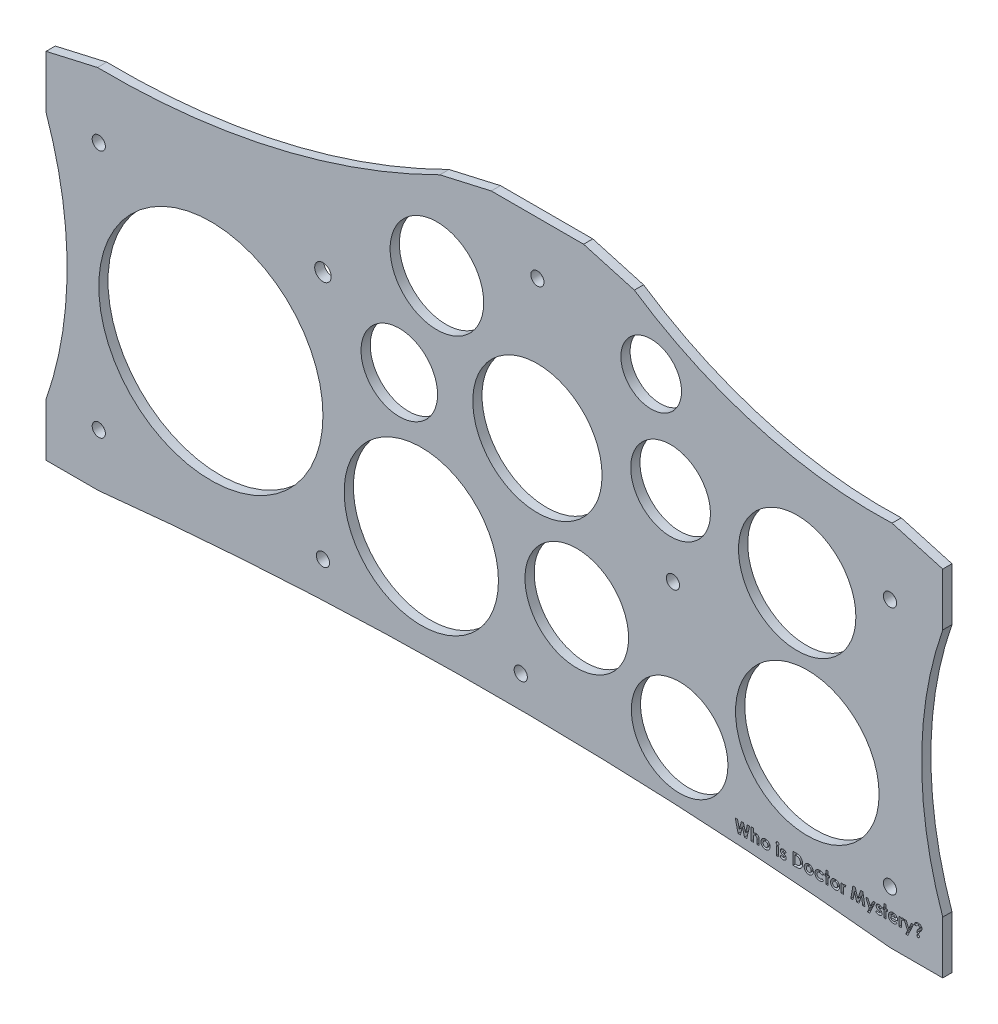
from build123d import *

# Parameters (mm, degrees)
SKETCH2_W           = 635
SKETCH2_H           = 635
BOSS_EXTRUDE3_DEPTH = 4.445
SKETCH3_R           = 3.175
SKETCH3_R_2         = 3.9751
CUT_EXTRUDE1_DEPTH  = 514.410627343
SKETCH5_W           = 635
SKETCH5_H           = 635
CUT_EXTRUDE2_DEPTH  = 514.410627343
SKETCH7_R           = 53.975
SKETCH7_R_2         = 37.157330496
SKETCH7_R_3         = 22.533954302
SKETCH7_R_4         = 28.26337169
SKETCH7_R_5         = 23.267660836
SKETCH7_R_6         = 24.953660215
SKETCH7_R_7         = 19.20011904
SKETCH7_R_8         = 34.562191292
SKETCH7_R_9         = 31.12444186
SKETCH7_R_10        = 14.598946735
SKETCH7_R_11        = 18.429776478
CUT_EXTRUDE3_DEPTH  = 348.246910316
SKETCH8_W           = 1.044764957
SKETCH8_H           = 4.253685897
CUT_EXTRUDE4_DEPTH  = 2.54


with BuildPart() as part:
    # Sketch2 → Boss-Extrude3 (new body)
    with BuildSketch(Plane.XY):
        with Locations((84.381748098, -1.971086)):
            Rectangle(SKETCH2_W, SKETCH2_H)
    extrude(amount=BOSS_EXTRUDE3_DEPTH)

    # Sketch3 → Cut-Extrude1 (cut, through all)
    with BuildSketch(Plane(origin=(0, 0, 0), x_dir=(-1, 0, 0), z_dir=(0, 0, -1))):
        with Locations((-130.02651813, 72.45351862)):
            Circle(SKETCH3_R)
        with Locations((-195.288059763, -21.383687133)):
            Circle(SKETCH3_R)
        with Locations((-122.004659563, -96.265887155)):
            Circle(SKETCH3_R)
        with Locations((-26.754659563, -96.265887155)):
            Circle(SKETCH3_R)
        with Locations((-26.754659563, 23.469712845)):
            Circle(SKETCH3_R_2)
        with Locations((81.195340437, -96.265887155)):
            Circle(SKETCH3_R)
        with Locations((-299.804659563, -96.265887155)):
            Circle(SKETCH3_R)
        with Locations((81.195340437, 23.469712845)):
            Circle(SKETCH3_R)
        with Locations((-299.804659563, 23.469712845)):
            Circle(SKETCH3_R)
    extrude(amount=-CUT_EXTRUDE1_DEPTH, mode=Mode.SUBTRACT)

    # Sketch5 → Cut-Extrude2 (cut, through all)
    with BuildSketch(Plane.XY.offset(4.445)):
        with Locations((84.381748098, -1.971086)):
            Rectangle(SKETCH5_W, SKETCH5_H)
        Polygon((-106.595340437, -121.665887155), (325.204659563, -121.665887155), (325.204659563, 48.869712845), (152.25151813, 97.85351862), (107.80151813, 97.85351862), (-106.595340437, 48.869712845), align=None, mode=Mode.SUBTRACT)
    extrude(amount=-CUT_EXTRUDE2_DEPTH, mode=Mode.SUBTRACT)

    # Sketch7 → Cut-Extrude3 (cut, through all)
    with BuildSketch(Plane.XY.offset(4.445)):
        with Locations((-27.220340437, -36.398087155)):
            Circle(SKETCH7_R)
        with Locations((74.10677236, -63.066358)):
            Circle(SKETCH7_R_2)
        with Locations((81.624703531, 49.369123819)):
            Circle(SKETCH7_R_3)
        with Locations((255.112790832, 8.034109887)):
            Circle(SKETCH7_R_4)
        with Locations((198.495772121, -84.726721616)):
            Circle(SKETCH7_R_5)
        with Locations((148.970957877, -55.570984198)):
            Circle(SKETCH7_R_6)
        with Locations((194.142903594, 16.063563046)):
            Circle(SKETCH7_R_7)
        with Locations((259.986345083, -60.383428814)):
            Circle(SKETCH7_R_8)
        with Locations((130.029497731, 5.831968497)):
            Circle(SKETCH7_R_9)
        with Locations((184.807527235, 59.988096069)):
            Circle(SKETCH7_R_10)
        with Locations((63.518572451, 0)):
            Circle(SKETCH7_R_11)
        with BuildLine():
            Line((-106.595340437, 23.469712845), (-106.595340437, -96.265887155))
            ThreePointArc((-106.595340437, -96.265887155), (-96.435340437, -36.398087155), (-106.595340437, 23.469712845))
        make_face()
        with BuildLine():
            Line((-81.195340437, -121.665887155), (299.804659563, -121.665887155))
            ThreePointArc((299.804659563, -121.665887155), (109.304659563, -111.505887155), (-81.195340437, -121.665887155))
        make_face()
        with BuildLine():
            Line((325.204659563, -96.265887155), (325.204659563, 23.469712845))
            ThreePointArc((325.204659563, 23.469712845), (315.044659563, -36.398087155), (325.204659563, -96.265887155))
        make_face()
        with BuildLine():
            Line((300.765915043, 55.791256478), (176.69026265, 90.931974987))
            ThreePointArc((176.69026265, 90.931974987), (235.959471393, 63.586117924), (300.765915043, 55.791256478))
        make_face()
        with BuildLine():
            Line((83.039580539, 92.196094581), (-81.833402846, 54.527136884))
            ThreePointArc((-81.833402846, 54.527136884), (2.866058462, 63.456840696), (83.039580539, 92.196094581))
        make_face()
    extrude(amount=-CUT_EXTRUDE3_DEPTH, mode=Mode.SUBTRACT)

    # Sketch8 → Cut-Extrude4 (cut)
    # profile 1 of 21: a face of its own
    with BuildSketch(Plane.XY.offset(4.445)):
        Polygon((225.310119164, -104.87912692), (226.388699059, -104.87912692), (227.250396942, -108.595271919), (228.238026316, -104.87912692), (229.253640465, -104.87912692), (230.235439677, -108.595271919), (231.094805496, -104.87912692), (232.175717455, -104.87912692), (230.828950127, -110.699960253), (229.737543877, -110.699960253), (228.74291831, -106.937173962), (227.74246258, -110.699960253), (226.659218557, -110.699960253), align=None)
    # profile 2 of 21: a face of its own
    with BuildSketch(Plane.XY.offset(4.445)):
        with BuildLine():
            Line((232.959291173, -104.729874783), (234.00405613, -104.729874783))
            Line((234.00405613, -104.729874783), (234.00405613, -106.906857122))
            add(Edge.make_bspline(
                [(234.00405613, -106.906857122), (234.056683155, -106.864057716), (234.159262347, -106.780634258), (234.320212462, -106.671953288), (234.48082967, -106.579211034), (234.642818359, -106.504049778), (234.805475762, -106.445150303), (234.969082761, -106.403379779), (235.133796859, -106.375974628), (235.244218729, -106.373091939), (235.299518036, -106.371648287)],
                knots=[0, 0, 0, 0, 1.13710654, 2.216417683, 3.252896077, 4.244436563, 5.207303112, 6.149540546, 7.073289332, 8, 8, 8, 8], degree=3))
            add(Edge.make_bspline(
                [(235.299518036, -106.371648287), (235.35243576, -106.373052416), (235.456317698, -106.375808837), (235.608718799, -106.395718861), (235.754688618, -106.429978878), (235.894586747, -106.477075212), (236.027450712, -106.540412843), (236.155008262, -106.61460488), (236.275743203, -106.703493881), (236.349203539, -106.772013858), (236.386260156, -106.806578342)],
                knots=[0, 0, 0, 0, 1.056403236, 2.073808271, 3.062028718, 4.046096703, 5.014652014, 5.995532726, 6.988858718, 8, 8, 8, 8], degree=3))
            add(Edge.make_bspline(
                [(236.386260156, -106.806578342), (236.416693422, -106.838875687), (236.478001509, -106.903938979), (236.554359095, -107.016106592), (236.620293108, -107.138284956), (236.674019929, -107.271622173), (236.713977392, -107.41618031), (236.744912571, -107.570768476), (236.762020382, -107.737074596), (236.764131723, -107.851694841), (236.76522066, -107.910810948)],
                knots=[0, 0, 0, 0, 0.887296576, 1.787466942, 2.706642908, 3.663267187, 4.658426068, 5.705361056, 6.816525637, 8, 8, 8, 8], degree=3))
            Line((236.76522066, -107.910810948), (236.76522066, -110.699960253))
            Line((236.76522066, -110.699960253), (235.720455703, -110.699960253))
            Line((235.720455703, -110.699960253), (235.720455703, -108.850632996))
            add(Edge.make_bspline(
                [(235.720455703, -108.850632996), (235.720252703, -108.791940932), (235.71986414, -108.679598267), (235.716374835, -108.518271249), (235.710676692, -108.371711822), (235.702884222, -108.239875693), (235.69200423, -108.123313828), (235.681302994, -108.021190756), (235.666286652, -107.93399599), (235.643801583, -107.83925059), (235.607209122, -107.737912738), (235.55403432, -107.629890944), (235.483007395, -107.540739764), (235.400811294, -107.467212391), (235.305773389, -107.411093518), (235.201295942, -107.369645093), (235.085592854, -107.346335524), (235.005392681, -107.343342892), (234.963700728, -107.341787176)],
                knots=[0, 0, 0, 0, 1.461461505, 2.797388094, 4.017818807, 5.113567707, 6.085313608, 6.932873269, 7.669572396, 8.286941306, 9.355291607, 10.346554054, 11.270113241, 12.175128673, 13.078071705, 14.003657132, 14.962203834, 16, 16, 16, 16], degree=3))
            add(Edge.make_bspline(
                [(234.963700728, -107.341787176), (234.909388465, -107.343910422), (234.803011776, -107.348069037), (234.650462898, -107.390877006), (234.509756626, -107.458540436), (234.382535135, -107.552318905), (234.271675106, -107.669780173), (234.17879151, -107.807456509), (234.102817814, -107.963970851), (234.069980615, -108.078103816), (234.053029487, -108.137021217)],
                knots=[0, 0, 0, 0, 0.993549393, 1.945978497, 2.879753144, 3.843180486, 4.826017097, 5.826060929, 6.877775219, 8, 8, 8, 8], degree=3))
            add(Edge.make_bspline(
                [(234.053029487, -108.137021217), (234.04880862, -108.155231729), (234.039183663, -108.196757655), (234.031812688, -108.267608017), (234.020874278, -108.353253963), (234.01707992, -108.454208732), (234.009972186, -108.570316609), (234.007415966, -108.701765451), (234.004842501, -108.848678837), (234.00432668, -108.951687111), (234.00405613, -109.005715295)],
                knots=[0, 0, 0, 0, 0.514379255, 1.17295301, 1.959069106, 2.891908278, 3.953016936, 5.163065833, 6.51201855, 8, 8, 8, 8], degree=3))
            Line((234.00405613, -109.005715295), (234.00405613, -110.699960253))
            Line((234.00405613, -110.699960253), (232.959291173, -110.699960253))
            Line((232.959291173, -110.699960253), (232.959291173, -104.729874783))
        make_face()
    # profile 3 of 21: a face of its own
    with BuildSketch(Plane.XY.offset(4.445)):
        with BuildLine():
            add(Edge.make_bspline(
                [(239.836549787, -106.371648287), (239.885944257, -106.372527296), (239.98376769, -106.374268131), (240.129463472, -106.388758992), (240.272612157, -106.412401429), (240.414036542, -106.443014258), (240.552423372, -106.485907411), (240.688498467, -106.537351115), (240.823478513, -106.596414504), (240.954013331, -106.666720595), (241.081045938, -106.742973963), (241.201480409, -106.827087684), (241.31431662, -106.918401074), (241.421649194, -107.014796961), (241.518476261, -107.120472105), (241.610985589, -107.230334636), (241.694179125, -107.348320546), (241.771204355, -107.471554789), (241.839779364, -107.599324727), (241.899324147, -107.730741546), (241.95100342, -107.863988316), (241.991467256, -108.000688074), (242.024967582, -108.139038252), (242.046108669, -108.280734227), (242.061138516, -108.424320427), (242.062823838, -108.520994473), (242.063671515, -108.569619208)],
                knots=[0, 0, 0, 0, 1.022364134, 2.024744242, 3.027414945, 4.024939316, 5.017584196, 6.023349371, 7.035562955, 8.064994934, 9.090267829, 10.101425541, 11.102933353, 12.093946398, 13.084502048, 14.067315274, 15.065326281, 16.070028806, 17.074376865, 18.064572984, 19.055292013, 20.030201733, 21.013838017, 21.999348303, 22.993720005, 24, 24, 24, 24], degree=3))
            add(Edge.make_bspline(
                [(242.063671515, -108.569619208), (242.062776932, -108.618623823), (242.0609983, -108.716056108), (242.04665243, -108.860992913), (242.022919497, -109.003355219), (241.992189175, -109.143981705), (241.94945654, -109.281072923), (241.899528018, -109.416649649), (241.838238793, -109.548863923), (241.770479039, -109.679158078), (241.692958569, -109.803697955), (241.609837047, -109.922865798), (241.517715193, -110.033535276), (241.421663254, -110.139138556), (241.317125268, -110.236104609), (241.205769858, -110.326007904), (241.088561051, -110.40994755), (240.964655993, -110.485954164), (240.8356417, -110.552738465), (240.703693974, -110.612949963), (240.568041259, -110.663080334), (240.428964295, -110.703960271), (240.286378737, -110.735612583), (240.140599377, -110.757114375), (239.991940168, -110.772068623), (239.891779447, -110.773741686), (239.841213916, -110.774586322)],
                knots=[0, 0, 0, 0, 1.012026251, 2.012137606, 3.004615893, 3.992048833, 4.982446996, 5.968083444, 6.973977695, 7.990229942, 8.999482246, 10.001782172, 10.988562221, 11.971415814, 12.948383116, 13.930088534, 14.925840678, 15.924049238, 16.929462851, 17.924729459, 18.917889337, 19.913673841, 20.916777188, 21.931792057, 22.95587778, 24, 24, 24, 24], degree=3))
            add(Edge.make_bspline(
                [(239.841213916, -110.774586322), (239.767276798, -110.772416121), (239.621545612, -110.768138624), (239.40691803, -110.738838884), (239.200731773, -110.68840635), (239.002650864, -110.618104509), (238.81241799, -110.528015319), (238.631693352, -110.416516267), (238.458679233, -110.285802449), (238.296372367, -110.136978668), (238.14767729, -109.973705505), (238.01777425, -109.799412398), (237.907476057, -109.616711708), (237.816881945, -109.425395095), (237.746961765, -109.225200211), (237.696467465, -109.01672557), (237.667131903, -108.799385181), (237.662890583, -108.65171785), (237.66073348, -108.576615401)],
                knots=[0, 0, 0, 0, 1.029999031, 2.030143771, 3.011211297, 3.982305373, 4.953580601, 5.938004764, 6.935448627, 7.970290061, 9.001484052, 10.007591832, 10.993831261, 11.969999897, 12.951306496, 13.942897864, 14.953773953, 16, 16, 16, 16], degree=3))
            add(Edge.make_bspline(
                [(237.66073348, -108.576615401), (237.662965807, -108.49642245), (237.667353401, -108.338804809), (237.702192826, -108.107891373), (237.75782763, -107.886802701), (237.837687886, -107.676157249), (237.93970234, -107.47556651), (238.064238868, -107.285453551), (238.211912938, -107.10577531), (238.325001705, -106.99709975), (238.382507486, -106.941838091)],
                knots=[0, 0, 0, 0, 1.043912699, 2.05178951, 3.033892, 4.007821512, 4.978932272, 5.95884105, 6.962068106, 8, 8, 8, 8], degree=3))
            add(Edge.make_bspline(
                [(238.382507486, -106.941838091), (238.435274787, -106.896032392), (238.53937375, -106.805667229), (238.708500302, -106.691053835), (238.881666808, -106.59206283), (239.060948741, -106.510673812), (239.246845894, -106.449307805), (239.43840565, -106.404638843), (239.635588175, -106.377201857), (239.769222162, -106.373508885), (239.836549787, -106.371648287)],
                knots=[0, 0, 0, 0, 1.048115528, 2.067714963, 3.060638214, 4.039924844, 5.017819947, 5.994373833, 6.98952318, 8, 8, 8, 8], degree=3))
        make_face()
        with BuildLine():
            add(Edge.make_bspline(
                [(239.859870433, -107.341787176), (239.819420001, -107.343131615), (239.73979289, -107.345778156), (239.62257969, -107.359981437), (239.511718212, -107.389092281), (239.405006539, -107.426113308), (239.304332412, -107.475623715), (239.206938724, -107.533562301), (239.117889733, -107.606065312), (239.032876074, -107.68559581), (238.955702622, -107.773912294), (238.889943512, -107.870133038), (238.83118629, -107.970576836), (238.786633669, -108.078921063), (238.749762115, -108.192204355), (238.72480789, -108.312257027), (238.707441492, -108.437738024), (238.706152283, -108.523693367), (238.705498438, -108.567287143)],
                knots=[0, 0, 0, 0, 1.030650113, 2.02884584, 2.99876339, 3.944280128, 4.900564847, 5.851248946, 6.823638398, 7.81794922, 8.81432732, 9.802856497, 10.78262424, 11.771747962, 12.779760563, 13.812642396, 14.89064281, 16, 16, 16, 16], degree=3))
            add(Edge.make_bspline(
                [(238.705498438, -108.567287143), (238.706263526, -108.612418255), (238.707758743, -108.700618347), (238.72324203, -108.829402341), (238.74877448, -108.951617499), (238.785048091, -109.067075023), (238.830668281, -109.176603653), (238.886638963, -109.279588861), (238.953550847, -109.375411435), (239.029412682, -109.463953377), (239.112478152, -109.544323877), (239.2034948, -109.613294834), (239.298651192, -109.673221441), (239.400140246, -109.721351756), (239.506520529, -109.758512264), (239.618107839, -109.785872296), (239.735488567, -109.800612555), (239.815523672, -109.803151563), (239.856372336, -109.804447433)],
                knots=[0, 0, 0, 0, 1.141730614, 2.231293227, 3.276944405, 4.297399982, 5.28939179, 6.275415646, 7.257752684, 8.24146775, 9.222424823, 10.176631434, 11.126518621, 12.063689483, 13.012557477, 13.974037417, 14.965980454, 16, 16, 16, 16], degree=3))
            add(Edge.make_bspline(
                [(239.856372336, -109.804447433), (239.89724143, -109.803298055), (239.977368579, -109.801044607), (240.094887149, -109.78416984), (240.207044305, -109.757612283), (240.314333159, -109.720131947), (240.415886269, -109.670971429), (240.51209239, -109.610758125), (240.60379786, -109.540827844), (240.687978076, -109.458940905), (240.765902092, -109.370122832), (240.834236794, -109.273794418), (240.891339848, -109.170809184), (240.938174577, -109.061815115), (240.974519296, -108.946962023), (240.999629052, -108.825823013), (241.017004735, -108.698773503), (241.018264788, -108.611657216), (241.018906557, -108.567287143)],
                knots=[0, 0, 0, 0, 1.031504075, 2.022346795, 2.991027682, 3.937587355, 4.885570121, 5.833146507, 6.798790848, 7.791235734, 8.792807298, 9.778388351, 10.766749885, 11.760164525, 12.768777521, 13.802286646, 14.880660483, 16, 16, 16, 16], degree=3))
            add(Edge.make_bspline(
                [(241.018906557, -108.567287143), (241.018131737, -108.522932577), (241.016611287, -108.43589453), (241.001126897, -108.308673188), (240.975845015, -108.187925733), (240.939103555, -108.074167747), (240.893754525, -107.966101431), (240.837745155, -107.864279936), (240.770503283, -107.769204759), (240.694272662, -107.681347336), (240.609961989, -107.602104617), (240.52052561, -107.531439347), (240.423918389, -107.47299374), (240.321952737, -107.424813697), (240.21435737, -107.387746031), (240.101253084, -107.360230942), (239.982293247, -107.345700431), (239.901104526, -107.343105227), (239.859870433, -107.341787176)],
                knots=[0, 0, 0, 0, 1.123894411, 2.205445421, 3.243160173, 4.246488011, 5.231014757, 6.210004299, 7.185865357, 8.177612767, 9.153374344, 10.115157457, 11.061423229, 12.009021698, 12.96873347, 13.94135618, 14.954456845, 16, 16, 16, 16], degree=3))
        make_face(mode=Mode.SUBTRACT)
    # profile 4 of 21: a face of its own
    with BuildSketch(Plane.XY.offset(4.445)):
        with BuildLine():
            add(Edge.make_bspline(
                [(245.643390732, -104.655248715), (245.688420094, -104.657458026), (245.776839586, -104.661796221), (245.903512539, -104.704083971), (246.019772638, -104.77045333), (246.12254979, -104.861513674), (246.208030214, -104.97025638), (246.273340433, -105.092001069), (246.309722035, -105.226890263), (246.314774901, -105.320070307), (246.317357412, -105.367694461)],
                knots=[0, 0, 0, 0, 0.989868614, 1.943702388, 2.910836514, 3.924849579, 4.949916355, 5.946401046, 6.950409252, 8, 8, 8, 8], degree=3))
            add(Edge.make_bspline(
                [(246.317357412, -105.367694461), (246.314867299, -105.414967651), (246.310015195, -105.507081714), (246.272503088, -105.640139724), (246.209814194, -105.761825281), (246.123641432, -105.868952956), (246.021978519, -105.958546719), (245.908258792, -106.026120975), (245.782799733, -106.066056267), (245.695752245, -106.070757111), (245.651552958, -106.073144014)],
                knots=[0, 0, 0, 0, 1.05296456, 2.051751585, 3.055639087, 4.085634717, 5.099016424, 6.062201612, 7.016062274, 8, 8, 8, 8], degree=3))
            add(Edge.make_bspline(
                [(245.651552958, -106.073144014), (245.606130527, -106.070942601), (245.51694179, -106.066620039), (245.389229857, -106.024233346), (245.271419146, -105.958386688), (245.169087841, -105.86546584), (245.082628475, -105.755950435), (245.020171032, -105.631371425), (244.981102357, -105.495559861), (244.976464939, -105.400999757), (244.974088181, -105.352536041)],
                knots=[0, 0, 0, 0, 0.989065327, 1.942068821, 2.907541208, 3.917690034, 4.939857478, 5.938239964, 6.943311734, 8, 8, 8, 8], degree=3))
            add(Edge.make_bspline(
                [(244.974088181, -105.352536041), (244.976674744, -105.306065578), (244.981755672, -105.214781062), (245.018355204, -105.08289085), (245.082167862, -104.963192879), (245.167032562, -104.856440811), (245.268906985, -104.767079085), (245.385097291, -104.702725406), (245.510917731, -104.662184261), (245.598777116, -104.657584434), (245.643390732, -104.655248715)],
                knots=[0, 0, 0, 0, 1.038616768, 2.040212704, 3.031499824, 4.052181184, 5.074969369, 6.039807101, 7.004644834, 8, 8, 8, 8], degree=3))
        make_face()
    # profile 5 of 21: a face of its own
    with BuildSketch(Plane.XY.offset(4.445)):
        with Locations((245.645722797, -108.573117305)):
            Rectangle(SKETCH8_W, SKETCH8_H)
    # profile 6 of 21: a face of its own
    with BuildSketch(Plane.XY.offset(4.445)):
        with BuildLine():
            Line((249.750156557, -107.102750551), (249.111170847, -107.789543587))
            add(Edge.make_bspline(
                [(249.111170847, -107.789543587), (249.079263229, -107.754236078), (249.018236043, -107.686706188), (248.92480932, -107.594647855), (248.832773903, -107.517990458), (248.743844864, -107.45359505), (248.656205957, -107.40421147), (248.570585656, -107.36868109), (248.486942881, -107.346125876), (248.431500914, -107.343206189), (248.404555262, -107.341787176)],
                knots=[0, 0, 0, 0, 1.327646587, 2.539285, 3.655602211, 4.666613517, 5.598770349, 6.454635452, 7.248928967, 8, 8, 8, 8], degree=3))
            add(Edge.make_bspline(
                [(248.404555262, -107.341787176), (248.377288969, -107.34261816), (248.325082499, -107.344209234), (248.251407472, -107.357856661), (248.186679032, -107.381482873), (248.131907307, -107.413687602), (248.087902734, -107.45336052), (248.057093081, -107.498745403), (248.036404115, -107.548430673), (248.034653962, -107.58372404), (248.033756985, -107.601812383)],
                knots=[0, 0, 0, 0, 1.295068245, 2.479652818, 3.543291146, 4.55379989, 5.481948265, 6.332409746, 7.145336708, 8, 8, 8, 8], degree=3))
            add(Edge.make_bspline(
                [(248.033756985, -107.601812383), (248.036796027, -107.629224042), (248.043101687, -107.686100048), (248.086412826, -107.75206773), (248.143716591, -107.800730738), (248.209771263, -107.846014462), (248.299226389, -107.896646514), (248.367089318, -107.931315759), (248.404555262, -107.950456047)],
                knots=[0, 0, 0, 0, 0.916701701, 1.902049539, 2.5493345, 3.440293453, 4.586830489, 6, 6, 6, 6], degree=3))
            Line((248.404555262, -107.950456047), (248.782349733, -108.141685347))
            add(Edge.make_bspline(
                [(248.782349733, -108.141685347), (248.830412413, -108.166090015), (248.923663041, -108.213439654), (249.054764689, -108.289844656), (249.17585226, -108.363901872), (249.284496775, -108.439800514), (249.381363207, -108.51622197), (249.465763518, -108.593921948), (249.539744842, -108.670437211), (249.622244402, -108.773023261), (249.704768724, -108.909659532), (249.773568377, -109.087348636), (249.817441079, -109.277614596), (249.822295089, -109.409304923), (249.824782626, -109.476792351)],
                knots=[0, 0, 0, 0, 1.076693506, 2.088987655, 3.030641824, 3.911722491, 4.735175175, 5.493635918, 6.202154166, 6.859459289, 8.120623445, 9.372284821, 10.653373066, 12, 12, 12, 12], degree=3))
            add(Edge.make_bspline(
                [(249.824782626, -109.476792351), (249.823283869, -109.52232224), (249.820350403, -109.611436316), (249.801805653, -109.742603739), (249.76849448, -109.867324538), (249.724657026, -109.987542861), (249.665609289, -110.101084795), (249.593922443, -110.20850075), (249.510728451, -110.31120104), (249.413827958, -110.40567249), (249.307675089, -110.493718847), (249.189668261, -110.567772156), (249.065025223, -110.632882035), (248.930453103, -110.683727054), (248.787840116, -110.724948854), (248.635963773, -110.753514529), (248.475339423, -110.771491641), (248.365348722, -110.773537245), (248.308940612, -110.774586322)],
                knots=[0, 0, 0, 0, 0.976600749, 1.911466839, 2.833459288, 3.740827163, 4.650527853, 5.570709661, 6.506801416, 7.479409329, 8.468875524, 9.458587492, 10.461481786, 11.480119772, 12.538142914, 13.641687514, 14.790552763, 16, 16, 16, 16], degree=3))
            add(Edge.make_bspline(
                [(248.308940612, -110.774586322), (248.234204711, -110.772206398), (248.087504717, -110.767534819), (247.873259997, -110.734993262), (247.670956103, -110.678663278), (247.480426596, -110.599752177), (247.300504508, -110.499197801), (247.13375933, -110.374431833), (246.977300381, -110.228704951), (246.886270939, -110.11693922), (246.839739891, -110.05980851)],
                knots=[0, 0, 0, 0, 1.056901255, 2.07460411, 3.05625841, 4.019970729, 4.984811261, 5.963335951, 6.958928997, 8, 8, 8, 8], degree=3))
            Line((246.839739891, -110.05980851), (247.47289544, -109.356691022))
            add(Edge.make_bspline(
                [(247.47289544, -109.356691022), (247.503744916, -109.389229287), (247.564991216, -109.453828384), (247.668227729, -109.539011027), (247.777459271, -109.616648739), (247.893901851, -109.681839086), (248.010367959, -109.734477358), (248.12210758, -109.773963425), (248.227014859, -109.798777752), (248.295222866, -109.802622541), (248.327597129, -109.804447433)],
                knots=[0, 0, 0, 0, 1.087861918, 2.159761696, 3.243809206, 4.338405912, 5.394481878, 6.343674753, 7.213841449, 8, 8, 8, 8], degree=3))
            add(Edge.make_bspline(
                [(248.327597129, -109.804447433), (248.359953868, -109.80351036), (248.42215245, -109.801709047), (248.510552741, -109.782971861), (248.588905992, -109.751471883), (248.655352466, -109.707796365), (248.710620866, -109.657663539), (248.749563488, -109.600687289), (248.775314412, -109.540270778), (248.778444135, -109.498029853), (248.780017669, -109.476792351)],
                knots=[0, 0, 0, 0, 1.255011871, 2.412479185, 3.488767498, 4.514443302, 5.48617286, 6.365347346, 7.178144445, 8, 8, 8, 8], degree=3))
            add(Edge.make_bspline(
                [(248.780017669, -109.476792351), (248.77861361, -109.456792772), (248.775730808, -109.415729781), (248.752907568, -109.355117868), (248.717074632, -109.295102348), (248.667376306, -109.235514011), (248.603151289, -109.176836346), (248.524629427, -109.11953934), (248.433622221, -109.060566129), (248.366399119, -109.02536702), (248.331095226, -109.006881327)],
                knots=[0, 0, 0, 0, 0.704666567, 1.446816302, 2.258757648, 3.165368109, 4.175243826, 5.322435858, 6.59381024, 8, 8, 8, 8], degree=3))
            Line((248.331095226, -109.006881327), (247.984783627, -108.831976479))
            add(Edge.make_bspline(
                [(247.984783627, -108.831976479), (247.906226332, -108.789850915), (247.755425779, -108.708985626), (247.551599804, -108.57031884), (247.379090541, -108.422705286), (247.23775741, -108.266937996), (247.125142892, -108.103454089), (247.04658671, -107.930172095), (246.997167696, -107.748734768), (246.991730813, -107.624665955), (246.988992027, -107.562167285)],
                knots=[0, 0, 0, 0, 1.255999728, 2.41104856, 3.467751088, 4.449286722, 5.368722015, 6.253902015, 7.120417131, 8, 8, 8, 8], degree=3))
            add(Edge.make_bspline(
                [(246.988992027, -107.562167285), (246.989941816, -107.521661521), (246.991806404, -107.442142125), (247.011656068, -107.325362382), (247.04164465, -107.213107361), (247.08396177, -107.105198791), (247.138169262, -107.001529599), (247.204582845, -106.90255986), (247.284012756, -106.808469502), (247.373916112, -106.71956161), (247.473666707, -106.638589365), (247.580414514, -106.566829021), (247.693843794, -106.505702552), (247.814885445, -106.456968183), (247.942000963, -106.418178658), (248.076029444, -106.391812306), (248.216399063, -106.375043214), (248.312389495, -106.372795964), (248.361412066, -106.371648287)],
                knots=[0, 0, 0, 0, 0.959035663, 1.882742823, 2.798841253, 3.708806893, 4.623422363, 5.566085165, 6.527241613, 7.536786942, 8.55815439, 9.567237405, 10.580975912, 11.605536372, 12.654523293, 13.725718749, 14.838518481, 16, 16, 16, 16], degree=3))
            add(Edge.make_bspline(
                [(248.361412066, -106.371648287), (248.429186087, -106.373879688), (248.563705563, -106.378308624), (248.762095333, -106.414147601), (248.953719273, -106.47438465), (249.138040171, -106.557381229), (249.312687084, -106.661684342), (249.473819443, -106.788343548), (249.622527735, -106.934239924), (249.707191157, -107.04602256), (249.750156557, -107.102750551)],
                knots=[0, 0, 0, 0, 0.996590028, 1.978055413, 2.954661574, 3.945146934, 4.945404762, 5.939399542, 6.954276554, 8, 8, 8, 8], degree=3))
        make_face()
    # profile 7 of 21: a face of its own
    with BuildSketch(Plane.XY.offset(4.445)):
        with BuildLine():
            Line((253.108329634, -104.87912692), (254.424780122, -104.87912692))
            add(Edge.make_bspline(
                [(254.424780122, -104.87912692), (254.527412579, -104.879844356), (254.72580228, -104.881231168), (255.013229707, -104.896857203), (255.280500639, -104.920888935), (255.527787364, -104.953948939), (255.754582903, -104.997696377), (255.960594808, -105.052568963), (256.146514505, -105.115910235), (256.314380565, -105.190444095), (256.467626132, -105.277343173), (256.613137688, -105.37414177), (256.750629526, -105.484385901), (256.882031125, -105.605948737), (257.005646721, -105.741054232), (257.123534955, -105.88746455), (257.232809389, -106.047302843), (257.336773153, -106.216736692), (257.430794543, -106.396484143), (257.512803513, -106.585015221), (257.581502924, -106.78111666), (257.637324754, -106.984997453), (257.681821194, -107.195980777), (257.712954457, -107.414492377), (257.73220135, -107.640329947), (257.734153786, -107.793391157), (257.735145874, -107.871165849)],
                knots=[0, 0, 0, 0, 1.44355588, 2.790409838, 4.047694926, 5.217575253, 6.298404546, 7.294384826, 8.214239204, 9.058592145, 9.873746385, 10.689560431, 11.514393297, 12.350027578, 13.205127629, 14.088021785, 14.991911688, 15.926770944, 16.882954281, 17.842803888, 18.816321264, 19.80318086, 20.814351908, 21.847355356, 22.906180909, 24, 24, 24, 24], degree=3))
            add(Edge.make_bspline(
                [(257.735145874, -107.871165849), (257.732548053, -107.980911001), (257.72743409, -108.196950758), (257.684356924, -108.513986613), (257.61468656, -108.8178971), (257.516723701, -109.106304914), (257.39527598, -109.376641741), (257.250193077, -109.624140304), (257.083602246, -109.847472157), (256.897444281, -110.04552529), (256.695880542, -110.215754642), (256.486415173, -110.361543624), (256.267007597, -110.476510402), (256.07367886, -110.549416531), (255.906038726, -110.594757836), (255.758852502, -110.621554983), (255.591663969, -110.646129584), (255.40291424, -110.665120307), (255.193431318, -110.682055365), (254.962380203, -110.691257216), (254.710508971, -110.698902588), (254.535560586, -110.69959846), (254.444602671, -110.699960253)],
                knots=[0, 0, 0, 0, 1.315458931, 2.589557908, 3.828601765, 5.048913369, 6.235739168, 7.376350998, 8.481830359, 9.569842114, 10.627874879, 11.640079404, 12.624025415, 13.590060155, 14.111227486, 14.704434459, 15.382649715, 16.137166398, 16.978595427, 17.902333227, 18.909396075, 20, 20, 20, 20], degree=3))
            Line((254.444602671, -110.699960253), (253.108329634, -110.699960253))
            Line((253.108329634, -110.699960253), (253.108329634, -104.87912692))
        make_face()
        with BuildLine():
            Line((254.153094592, -105.923891877), (254.153094592, -109.655195296))
            Line((254.153094592, -109.655195296), (254.698797717, -109.655195296))
            add(Edge.make_bspline(
                [(254.698797717, -109.655195296), (254.763728008, -109.655076317), (254.888610573, -109.65484748), (255.068912729, -109.643947797), (255.235646506, -109.633007521), (255.388352926, -109.612242512), (255.528143337, -109.589111752), (255.653097386, -109.556922133), (255.76579092, -109.523109665), (255.864847407, -109.480062202), (255.955575078, -109.431609418), (256.039578538, -109.374841364), (256.120665397, -109.311802581), (256.197319669, -109.240639008), (256.269831473, -109.162292986), (256.337771783, -109.076360832), (256.402047423, -108.983104727), (256.461008558, -108.882031603), (256.514887558, -108.774208815), (256.562684269, -108.660680785), (256.602314796, -108.540502067), (256.635253263, -108.41479768), (256.658791533, -108.282473224), (256.678264962, -108.144508808), (256.688304082, -108.000357829), (256.689681888, -107.902272685), (256.690380916, -107.852509332)],
                knots=[0, 0, 0, 0, 1.50275155, 2.890291501, 4.180787663, 5.369391935, 6.45668281, 7.458360028, 8.354766181, 9.177074746, 9.954075863, 10.732690366, 11.5210699, 12.329727389, 13.151100085, 13.990027547, 14.863562427, 15.770965086, 16.696477834, 17.652329173, 18.619756807, 19.62365428, 20.657822005, 21.729286259, 22.847956731, 24, 24, 24, 24], degree=3))
            add(Edge.make_bspline(
                [(256.690380916, -107.852509332), (256.68898869, -107.776251697), (256.686273955, -107.627555219), (256.660093645, -107.410975552), (256.617477093, -107.207033351), (256.55666738, -107.016485499), (256.480014852, -106.838796458), (256.384066345, -106.675471629), (256.272951113, -106.52376738), (256.185084219, -106.434772801), (256.141179694, -106.390304805)],
                knots=[0, 0, 0, 0, 1.13821349, 2.219428113, 3.251817212, 4.244760574, 5.201143372, 6.134805572, 7.068016741, 8, 8, 8, 8], degree=3))
            add(Edge.make_bspline(
                [(256.141179694, -106.390304805), (256.097885676, -106.35241206), (256.009462546, -106.275020421), (255.854220588, -106.182285446), (255.68315199, -106.10080868), (255.492343215, -106.036206691), (255.283638346, -105.985116685), (255.055794333, -105.949881156), (254.810031329, -105.927239179), (254.639772447, -105.925031549), (254.551877644, -105.923891877)],
                knots=[0, 0, 0, 0, 0.813307809, 1.661089106, 2.549956539, 3.493439533, 4.508053171, 5.589449661, 6.755572447, 8, 8, 8, 8], degree=3))
            Line((254.551877644, -105.923891877), (254.153094592, -105.923891877))
        make_face(mode=Mode.SUBTRACT)
    # profile 8 of 21: a face of its own
    with BuildSketch(Plane.XY.offset(4.445)):
        with BuildLine():
            add(Edge.make_bspline(
                [(260.657222863, -106.371648287), (260.706617334, -106.372527296), (260.804440767, -106.374268131), (260.950136549, -106.388758992), (261.093285234, -106.412401429), (261.234709619, -106.443014258), (261.373096449, -106.485907411), (261.509171544, -106.537351115), (261.64415159, -106.596414504), (261.774686408, -106.666720595), (261.901719014, -106.742973963), (262.022153486, -106.827087684), (262.134989697, -106.918401074), (262.242322271, -107.014796961), (262.339149338, -107.120472105), (262.431658666, -107.230334636), (262.514852202, -107.348320546), (262.591877432, -107.471554789), (262.660452441, -107.599324727), (262.719997224, -107.730741546), (262.771676497, -107.863988316), (262.812140333, -108.000688074), (262.845640659, -108.139038252), (262.866781746, -108.280734227), (262.881811593, -108.424320427), (262.883496915, -108.520994473), (262.884344592, -108.569619208)],
                knots=[0, 0, 0, 0, 1.022364134, 2.024744242, 3.027414945, 4.024939316, 5.017584196, 6.023349371, 7.035562955, 8.064994934, 9.090267829, 10.101425541, 11.102933353, 12.093946398, 13.084502048, 14.067315274, 15.065326281, 16.070028806, 17.074376865, 18.064572984, 19.055292013, 20.030201733, 21.013838017, 21.999348303, 22.993720005, 24, 24, 24, 24], degree=3))
            add(Edge.make_bspline(
                [(262.884344592, -108.569619208), (262.883450009, -108.618623823), (262.881671377, -108.716056108), (262.867325507, -108.860992913), (262.843592574, -109.003355219), (262.812862251, -109.143981705), (262.770129617, -109.281072923), (262.720201095, -109.416649649), (262.65891187, -109.548863923), (262.591152116, -109.679158078), (262.513631646, -109.803697955), (262.430510124, -109.922865798), (262.33838827, -110.033535276), (262.242336331, -110.139138556), (262.137798345, -110.236104609), (262.026442935, -110.326007904), (261.909234128, -110.40994755), (261.785329069, -110.485954164), (261.656314776, -110.552738465), (261.524367051, -110.612949963), (261.388714336, -110.663080334), (261.249637372, -110.703960271), (261.107051814, -110.735612583), (260.961272453, -110.757114375), (260.812613245, -110.772068623), (260.712452524, -110.773741686), (260.661886993, -110.774586322)],
                knots=[0, 0, 0, 0, 1.012026251, 2.012137606, 3.004615893, 3.992048833, 4.982446996, 5.968083444, 6.973977695, 7.990229942, 8.999482246, 10.001782172, 10.988562221, 11.971415814, 12.948383116, 13.930088534, 14.925840678, 15.924049238, 16.929462851, 17.924729459, 18.917889337, 19.913673841, 20.916777188, 21.931792057, 22.95587778, 24, 24, 24, 24], degree=3))
            add(Edge.make_bspline(
                [(260.661886993, -110.774586322), (260.587949875, -110.772416121), (260.442218689, -110.768138624), (260.227591107, -110.738838884), (260.02140485, -110.68840635), (259.823323941, -110.618104509), (259.633091067, -110.528015319), (259.452366429, -110.416516267), (259.27935231, -110.285802449), (259.117045444, -110.136978668), (258.968350367, -109.973705505), (258.838447327, -109.799412398), (258.728149134, -109.616711708), (258.637555022, -109.425395095), (258.567634842, -109.225200211), (258.517140542, -109.01672557), (258.48780498, -108.799385181), (258.48356366, -108.65171785), (258.481406557, -108.576615401)],
                knots=[0, 0, 0, 0, 1.029999031, 2.030143771, 3.011211297, 3.982305373, 4.953580601, 5.938004764, 6.935448627, 7.970290061, 9.001484052, 10.007591832, 10.993831261, 11.969999897, 12.951306496, 13.942897864, 14.953773953, 16, 16, 16, 16], degree=3))
            add(Edge.make_bspline(
                [(258.481406557, -108.576615401), (258.483638884, -108.49642245), (258.488026478, -108.338804809), (258.522865903, -108.107891373), (258.578500707, -107.886802701), (258.658360963, -107.676157249), (258.760375417, -107.47556651), (258.884911945, -107.285453551), (259.032586015, -107.10577531), (259.145674782, -106.99709975), (259.203180562, -106.941838091)],
                knots=[0, 0, 0, 0, 1.043912699, 2.05178951, 3.033892, 4.007821512, 4.978932272, 5.95884105, 6.962068106, 8, 8, 8, 8], degree=3))
            add(Edge.make_bspline(
                [(259.203180562, -106.941838091), (259.255947864, -106.896032392), (259.360046827, -106.805667229), (259.529173379, -106.691053835), (259.702339885, -106.59206283), (259.881621818, -106.510673812), (260.067518971, -106.449307805), (260.259078727, -106.404638843), (260.456261252, -106.377201857), (260.589895239, -106.373508885), (260.657222863, -106.371648287)],
                knots=[0, 0, 0, 0, 1.048115528, 2.067714963, 3.060638214, 4.039924844, 5.017819947, 5.994373833, 6.98952318, 8, 8, 8, 8], degree=3))
        make_face()
        with BuildLine():
            add(Edge.make_bspline(
                [(260.68054351, -107.341787176), (260.640093078, -107.343131615), (260.560465967, -107.345778156), (260.443252767, -107.359981437), (260.332391289, -107.389092281), (260.225679616, -107.426113308), (260.125005489, -107.475623715), (260.027611801, -107.533562301), (259.93856281, -107.606065312), (259.853549151, -107.68559581), (259.776375699, -107.773912294), (259.710616589, -107.870133038), (259.651859367, -107.970576836), (259.607306746, -108.078921063), (259.570435192, -108.192204355), (259.545480967, -108.312257027), (259.528114569, -108.437738024), (259.52682536, -108.523693367), (259.526171515, -108.567287143)],
                knots=[0, 0, 0, 0, 1.030650113, 2.02884584, 2.99876339, 3.944280128, 4.900564847, 5.851248946, 6.823638398, 7.81794922, 8.81432732, 9.802856497, 10.78262424, 11.771747962, 12.779760563, 13.812642396, 14.89064281, 16, 16, 16, 16], degree=3))
            add(Edge.make_bspline(
                [(259.526171515, -108.567287143), (259.526936602, -108.612418255), (259.52843182, -108.700618347), (259.543915107, -108.829402341), (259.569447557, -108.951617499), (259.605721168, -109.067075023), (259.651341358, -109.176603653), (259.70731204, -109.279588861), (259.774223924, -109.375411435), (259.850085759, -109.463953377), (259.933151229, -109.544323877), (260.024167877, -109.613294834), (260.119324269, -109.673221441), (260.220813323, -109.721351756), (260.327193606, -109.758512264), (260.438780916, -109.785872296), (260.556161643, -109.800612555), (260.636196749, -109.803151563), (260.677045413, -109.804447433)],
                knots=[0, 0, 0, 0, 1.141730614, 2.231293227, 3.276944405, 4.297399982, 5.28939179, 6.275415646, 7.257752684, 8.24146775, 9.222424823, 10.176631434, 11.126518621, 12.063689483, 13.012557477, 13.974037417, 14.965980454, 16, 16, 16, 16], degree=3))
            add(Edge.make_bspline(
                [(260.677045413, -109.804447433), (260.717914507, -109.803298055), (260.798041656, -109.801044607), (260.915560226, -109.78416984), (261.027717382, -109.757612283), (261.135006236, -109.720131947), (261.236559346, -109.670971429), (261.332765467, -109.610758125), (261.424470936, -109.540827844), (261.508651153, -109.458940905), (261.586575169, -109.370122832), (261.654909871, -109.273794418), (261.712012925, -109.170809184), (261.758847654, -109.061815115), (261.795192373, -108.946962023), (261.820302129, -108.825823013), (261.837677812, -108.698773503), (261.838937864, -108.611657216), (261.839579634, -108.567287143)],
                knots=[0, 0, 0, 0, 1.031504075, 2.022346795, 2.991027682, 3.937587355, 4.885570121, 5.833146507, 6.798790848, 7.791235734, 8.792807298, 9.778388351, 10.766749885, 11.760164525, 12.768777521, 13.802286646, 14.880660483, 16, 16, 16, 16], degree=3))
            add(Edge.make_bspline(
                [(261.839579634, -108.567287143), (261.838804814, -108.522932577), (261.837284364, -108.43589453), (261.821799974, -108.308673188), (261.796518092, -108.187925733), (261.759776631, -108.074167747), (261.714427601, -107.966101431), (261.658418232, -107.864279936), (261.59117636, -107.769204759), (261.514945739, -107.681347336), (261.430635066, -107.602104617), (261.341198687, -107.531439347), (261.244591466, -107.47299374), (261.142625814, -107.424813697), (261.035030447, -107.387746031), (260.921926161, -107.360230942), (260.802966324, -107.345700431), (260.721777603, -107.343105227), (260.68054351, -107.341787176)],
                knots=[0, 0, 0, 0, 1.123894411, 2.205445421, 3.243160173, 4.246488011, 5.231014757, 6.210004299, 7.185865357, 8.177612767, 9.153374344, 10.115157457, 11.061423229, 12.009021698, 12.96873347, 13.94135618, 14.954456845, 16, 16, 16, 16], degree=3))
        make_face(mode=Mode.SUBTRACT)
    # profile 9 of 21: a face of its own
    with BuildSketch(Plane.XY.offset(4.445)):
        with BuildLine():
            Line((267.884291173, -107.313802401), (267.019095193, -107.789543587))
            add(Edge.make_bspline(
                [(267.019095193, -107.789543587), (266.979437762, -107.749830164), (266.903206211, -107.673490982), (266.780962791, -107.576857688), (266.660903701, -107.496848009), (266.538079401, -107.437804976), (266.411391988, -107.393339913), (266.276272, -107.363889724), (266.131142349, -107.344497822), (266.030756004, -107.342709354), (265.978994365, -107.341787176)],
                knots=[0, 0, 0, 0, 1.150764855, 2.212059359, 3.192108068, 4.105322427, 5.000809612, 5.941206042, 6.938435785, 8, 8, 8, 8], degree=3))
            add(Edge.make_bspline(
                [(265.978994365, -107.341787176), (265.931525369, -107.342933728), (265.838632524, -107.345177433), (265.702901337, -107.361936371), (265.573902753, -107.388258272), (265.451868331, -107.426767305), (265.337015426, -107.477639834), (265.228394255, -107.537839819), (265.127060329, -107.609718592), (265.034446031, -107.692254412), (264.95084535, -107.783124522), (264.876269276, -107.880041399), (264.81517386, -107.984442782), (264.762353085, -108.093874861), (264.723518606, -108.210393014), (264.695106356, -108.332939961), (264.678911639, -108.461521131), (264.67656531, -108.549364037), (264.675370233, -108.594105886)],
                knots=[0, 0, 0, 0, 1.121765476, 2.195200973, 3.227634963, 4.230038321, 5.213228299, 6.192116585, 7.160777141, 8.14345191, 9.118668839, 10.075979138, 11.027630062, 11.972829041, 12.943187208, 13.923755399, 14.94248691, 16, 16, 16, 16], degree=3))
            add(Edge.make_bspline(
                [(264.675370233, -108.594105886), (264.676632935, -108.637680121), (264.679098451, -108.7227619), (264.694245748, -108.847767309), (264.720542027, -108.966767124), (264.759969854, -109.079132229), (264.807228514, -109.185898469), (264.866576739, -109.286216711), (264.936366981, -109.38052502), (265.016966659, -109.46800372), (265.106250649, -109.546680078), (265.202505791, -109.616159447), (265.305444899, -109.675065098), (265.416267111, -109.721292795), (265.533165583, -109.758958698), (265.656920966, -109.785778295), (265.787401564, -109.800665027), (265.876346885, -109.803167141), (265.921858781, -109.804447433)],
                knots=[0, 0, 0, 0, 1.070556293, 2.090336998, 3.088792742, 4.058148387, 5.011235098, 5.952916408, 6.915475435, 7.888633318, 8.869583867, 9.83422472, 10.800707077, 11.776204622, 12.778807041, 13.814557445, 14.881744048, 16, 16, 16, 16], degree=3))
            add(Edge.make_bspline(
                [(265.921858781, -109.804447433), (265.977894833, -109.803165164), (266.087269064, -109.800662362), (266.246267454, -109.779434398), (266.395882764, -109.74433081), (266.536130859, -109.695744657), (266.66681553, -109.632217356), (266.787600993, -109.554623496), (266.899728918, -109.463535478), (266.965115747, -109.392521208), (266.998106611, -109.356691022)],
                knots=[0, 0, 0, 0, 1.116373375, 2.178998604, 3.189797796, 4.174590301, 5.13072713, 6.078291395, 7.030403691, 8, 8, 8, 8], degree=3))
            Line((266.998106611, -109.356691022), (267.809665104, -109.914054471))
            add(Edge.make_bspline(
                [(267.809665104, -109.914054471), (267.753411768, -109.982831288), (267.642400085, -110.118557108), (267.448715483, -110.293502735), (267.24025235, -110.443819901), (267.012818042, -110.563801159), (266.769724755, -110.659230911), (266.509072948, -110.726690272), (266.231303496, -110.766400723), (266.040536323, -110.771814175), (265.942847363, -110.774586322)],
                knots=[0, 0, 0, 0, 0.997876357, 1.969233105, 2.924898516, 3.881013542, 4.852507933, 5.855329832, 6.901747111, 8, 8, 8, 8], degree=3))
            add(Edge.make_bspline(
                [(265.942847363, -110.774586322), (265.85492124, -110.772553731), (265.683191827, -110.768583856), (265.432900475, -110.738182108), (265.197488462, -110.686974501), (264.976471508, -110.61585766), (264.770051118, -110.523734722), (264.578896731, -110.409467856), (264.401719015, -110.276235552), (264.241714965, -110.123408426), (264.09895464, -109.957054449), (263.974324362, -109.781857261), (263.866538397, -109.600955887), (263.781980412, -109.411339292), (263.712873234, -109.215962973), (263.666200414, -109.012491484), (263.635416816, -108.802600847), (263.632222031, -108.660292446), (263.630605275, -108.588275725)],
                knots=[0, 0, 0, 0, 1.183377041, 2.311265848, 3.387807024, 4.421911742, 5.431260577, 6.423665966, 7.413571885, 8.409103097, 9.395976332, 10.359992013, 11.300391101, 12.225292883, 13.150239058, 14.085544813, 15.031169026, 16, 16, 16, 16], degree=3))
            add(Edge.make_bspline(
                [(263.630605275, -108.588275725), (263.631471383, -108.538101064), (263.633186876, -108.438720488), (263.647831763, -108.291129251), (263.670614285, -108.146042577), (263.704853726, -108.004478901), (263.746962195, -107.865751406), (263.798150741, -107.729887978), (263.860438428, -107.597589696), (263.929920533, -107.467731152), (264.009110781, -107.343740419), (264.0955057, -107.22567222), (264.188983565, -107.11424967), (264.290642507, -107.010511196), (264.399773693, -106.913714507), (264.51479064, -106.821895778), (264.63941524, -106.739790312), (264.769315061, -106.662596009), (264.905609055, -106.593878211), (265.04673071, -106.534565691), (265.191589469, -106.484171152), (265.340532553, -106.443652925), (265.492920668, -106.410258478), (265.650109798, -106.389064989), (265.810799468, -106.374168541), (265.919491342, -106.372493437), (265.974330235, -106.371648287)],
                knots=[0, 0, 0, 0, 1.00272354, 1.986087015, 2.96193297, 3.936200312, 4.894695956, 5.858592327, 6.835334787, 7.815655071, 8.800643866, 9.773423113, 10.738352213, 11.705312252, 12.673769326, 13.65298065, 14.64420052, 15.654211674, 16.672258995, 17.692438602, 18.712115155, 19.735602823, 20.776372304, 21.827874031, 22.90408564, 24, 24, 24, 24], degree=3))
            add(Edge.make_bspline(
                [(265.974330235, -106.371648287), (266.025268532, -106.372224188), (266.125729624, -106.373359986), (266.274087948, -106.385236334), (266.418399358, -106.405408833), (266.558909446, -106.432096199), (266.696044938, -106.465166494), (266.827967856, -106.509248088), (266.956481808, -106.559279038), (267.122009136, -106.634820548), (267.31713556, -106.747578478), (267.531332095, -106.909298208), (267.722314236, -107.098486704), (267.830011886, -107.241649026), (267.884291173, -107.313802401)],
                knots=[0, 0, 0, 0, 0.826738014, 1.630502179, 2.413926014, 3.191023582, 3.95155221, 4.701751672, 5.446919844, 6.189438973, 7.653650558, 9.094719814, 10.535747635, 12, 12, 12, 12], degree=3))
        make_face()
    # profile 10 of 21: a face of its own
    with BuildSketch(Plane.XY.offset(4.445)):
        Polygon((269.003682198, -104.729874783), (270.048447156, -104.729874783), (270.048447156, -106.446274356), (270.720081771, -106.446274356), (270.720081771, -107.341787176), (270.048447156, -107.341787176), (270.048447156, -110.699960253), (269.003682198, -110.699960253), (269.003682198, -107.341787176), (268.48129972, -107.341787176), (268.48129972, -106.446274356), (269.003682198, -106.446274356), align=None)
    # profile 11 of 21: a face of its own
    with BuildSketch(Plane.XY.offset(4.445)):
        with BuildLine():
            add(Edge.make_bspline(
                [(273.343654487, -106.371648287), (273.393048958, -106.372527296), (273.49087239, -106.374268131), (273.636568173, -106.388758992), (273.779716858, -106.412401429), (273.921141243, -106.443014258), (274.059528073, -106.485907411), (274.195603168, -106.537351115), (274.330583214, -106.596414504), (274.461118032, -106.666720595), (274.588150638, -106.742973963), (274.70858511, -106.827087684), (274.821421321, -106.918401074), (274.928753895, -107.014796961), (275.025580962, -107.120472105), (275.11809029, -107.230334636), (275.201283826, -107.348320546), (275.278309056, -107.471554789), (275.346884064, -107.599324727), (275.406428848, -107.730741546), (275.458108121, -107.863988316), (275.498571957, -108.000688074), (275.532072283, -108.139038252), (275.55321337, -108.280734227), (275.568243217, -108.424320427), (275.569928539, -108.520994473), (275.570776216, -108.569619208)],
                knots=[0, 0, 0, 0, 1.022364134, 2.024744242, 3.027414945, 4.024939316, 5.017584196, 6.023349371, 7.035562955, 8.064994934, 9.090267829, 10.101425541, 11.102933353, 12.093946398, 13.084502048, 14.067315274, 15.065326281, 16.070028806, 17.074376865, 18.064572984, 19.055292013, 20.030201733, 21.013838017, 21.999348303, 22.993720005, 24, 24, 24, 24], degree=3))
            add(Edge.make_bspline(
                [(275.570776216, -108.569619208), (275.569881633, -108.618623823), (275.568103, -108.716056108), (275.553757131, -108.860992913), (275.530024198, -109.003355219), (275.499293875, -109.143981705), (275.456561241, -109.281072923), (275.406632719, -109.416649649), (275.345343494, -109.548863923), (275.27758374, -109.679158078), (275.20006327, -109.803697955), (275.116941748, -109.922865798), (275.024819894, -110.033535276), (274.928767955, -110.139138556), (274.824229969, -110.236104609), (274.712874559, -110.326007904), (274.595665752, -110.40994755), (274.471760693, -110.485954164), (274.3427464, -110.552738465), (274.210798675, -110.612949963), (274.07514596, -110.663080334), (273.936068996, -110.703960271), (273.793483438, -110.735612583), (273.647704077, -110.757114375), (273.499044869, -110.772068623), (273.398884148, -110.773741686), (273.348318617, -110.774586322)],
                knots=[0, 0, 0, 0, 1.012026251, 2.012137606, 3.004615893, 3.992048833, 4.982446996, 5.968083444, 6.973977695, 7.990229942, 8.999482246, 10.001782172, 10.988562221, 11.971415814, 12.948383116, 13.930088534, 14.925840678, 15.924049238, 16.929462851, 17.924729459, 18.917889337, 19.913673841, 20.916777188, 21.931792057, 22.95587778, 24, 24, 24, 24], degree=3))
            add(Edge.make_bspline(
                [(273.348318617, -110.774586322), (273.274381498, -110.772416121), (273.128650313, -110.768138624), (272.914022731, -110.738838884), (272.707836474, -110.68840635), (272.509755565, -110.618104509), (272.319522691, -110.528015319), (272.138798053, -110.416516267), (271.965783934, -110.285802449), (271.803477068, -110.136978668), (271.654781991, -109.973705505), (271.524878951, -109.799412398), (271.414580758, -109.616711708), (271.323986646, -109.425395095), (271.254066466, -109.225200211), (271.203572166, -109.01672557), (271.174236604, -108.799385181), (271.169995284, -108.65171785), (271.167838181, -108.576615401)],
                knots=[0, 0, 0, 0, 1.029999031, 2.030143771, 3.011211297, 3.982305373, 4.953580601, 5.938004764, 6.935448627, 7.970290061, 9.001484052, 10.007591832, 10.993831261, 11.969999897, 12.951306496, 13.942897864, 14.953773953, 16, 16, 16, 16], degree=3))
            add(Edge.make_bspline(
                [(271.167838181, -108.576615401), (271.170070508, -108.49642245), (271.174458102, -108.338804809), (271.209297527, -108.107891373), (271.264932331, -107.886802701), (271.344792587, -107.676157249), (271.446807041, -107.47556651), (271.571343569, -107.285453551), (271.719017639, -107.10577531), (271.832106406, -106.99709975), (271.889612186, -106.941838091)],
                knots=[0, 0, 0, 0, 1.043912699, 2.05178951, 3.033892, 4.007821512, 4.978932272, 5.95884105, 6.962068106, 8, 8, 8, 8], degree=3))
            add(Edge.make_bspline(
                [(271.889612186, -106.941838091), (271.942379488, -106.896032392), (272.046478451, -106.805667229), (272.215605003, -106.691053835), (272.388771509, -106.59206283), (272.568053442, -106.510673812), (272.753950595, -106.449307805), (272.945510351, -106.404638843), (273.142692876, -106.377201857), (273.276326863, -106.373508885), (273.343654487, -106.371648287)],
                knots=[0, 0, 0, 0, 1.048115528, 2.067714963, 3.060638214, 4.039924844, 5.017819947, 5.994373833, 6.98952318, 8, 8, 8, 8], degree=3))
        make_face()
        with BuildLine():
            add(Edge.make_bspline(
                [(273.366975134, -107.341787176), (273.326524702, -107.343131615), (273.246897591, -107.345778156), (273.129684391, -107.359981437), (273.018822913, -107.389092281), (272.91211124, -107.426113308), (272.811437112, -107.475623715), (272.714043425, -107.533562301), (272.624994434, -107.606065312), (272.539980775, -107.68559581), (272.462807322, -107.773912294), (272.397048212, -107.870133038), (272.338290991, -107.970576836), (272.29373837, -108.078921063), (272.256866816, -108.192204355), (272.231912591, -108.312257027), (272.214546193, -108.437738024), (272.213256984, -108.523693367), (272.212603139, -108.567287143)],
                knots=[0, 0, 0, 0, 1.030650113, 2.02884584, 2.99876339, 3.944280128, 4.900564847, 5.851248946, 6.823638398, 7.81794922, 8.81432732, 9.802856497, 10.78262424, 11.771747962, 12.779760563, 13.812642396, 14.89064281, 16, 16, 16, 16], degree=3))
            add(Edge.make_bspline(
                [(272.212603139, -108.567287143), (272.213368226, -108.612418255), (272.214863444, -108.700618347), (272.230346731, -108.829402341), (272.255879181, -108.951617499), (272.292152792, -109.067075023), (272.337772982, -109.176603653), (272.393743664, -109.279588861), (272.460655548, -109.375411435), (272.536517383, -109.463953377), (272.619582853, -109.544323877), (272.710599501, -109.613294834), (272.805755893, -109.673221441), (272.907244947, -109.721351756), (273.01362523, -109.758512264), (273.125212539, -109.785872296), (273.242593267, -109.800612555), (273.322628373, -109.803151563), (273.363477037, -109.804447433)],
                knots=[0, 0, 0, 0, 1.141730614, 2.231293227, 3.276944405, 4.297399982, 5.28939179, 6.275415646, 7.257752684, 8.24146775, 9.222424823, 10.176631434, 11.126518621, 12.063689483, 13.012557477, 13.974037417, 14.965980454, 16, 16, 16, 16], degree=3))
            add(Edge.make_bspline(
                [(273.363477037, -109.804447433), (273.404346131, -109.803298055), (273.48447328, -109.801044607), (273.60199185, -109.78416984), (273.714149006, -109.757612283), (273.82143786, -109.720131947), (273.92299097, -109.670971429), (274.019197091, -109.610758125), (274.11090256, -109.540827844), (274.195082777, -109.458940905), (274.273006793, -109.370122832), (274.341341495, -109.273794418), (274.398444549, -109.170809184), (274.445279278, -109.061815115), (274.481623997, -108.946962023), (274.506733753, -108.825823013), (274.524109436, -108.698773503), (274.525369488, -108.611657216), (274.526011258, -108.567287143)],
                knots=[0, 0, 0, 0, 1.031504075, 2.022346795, 2.991027682, 3.937587355, 4.885570121, 5.833146507, 6.798790848, 7.791235734, 8.792807298, 9.778388351, 10.766749885, 11.760164525, 12.768777521, 13.802286646, 14.880660483, 16, 16, 16, 16], degree=3))
            add(Edge.make_bspline(
                [(274.526011258, -108.567287143), (274.525236438, -108.522932577), (274.523715988, -108.43589453), (274.508231598, -108.308673188), (274.482949716, -108.187925733), (274.446208255, -108.074167747), (274.400859225, -107.966101431), (274.344849856, -107.864279936), (274.277607984, -107.769204759), (274.201377363, -107.681347336), (274.11706669, -107.602104617), (274.027630311, -107.531439347), (273.93102309, -107.47299374), (273.829057437, -107.424813697), (273.721462071, -107.387746031), (273.608357785, -107.360230942), (273.489397948, -107.345700431), (273.408209227, -107.343105227), (273.366975134, -107.341787176)],
                knots=[0, 0, 0, 0, 1.123894411, 2.205445421, 3.243160173, 4.246488011, 5.231014757, 6.210004299, 7.185865357, 8.177612767, 9.153374344, 10.115157457, 11.061423229, 12.009021698, 12.96873347, 13.94135618, 14.954456845, 16, 16, 16, 16], degree=3))
        make_face(mode=Mode.SUBTRACT)
    # profile 12 of 21: a face of its own
    with BuildSketch(Plane.XY.offset(4.445)):
        with BuildLine():
            Line((276.317036899, -106.446274356), (277.21254972, -106.446274356))
            Line((277.21254972, -106.446274356), (277.21254972, -106.969822867))
            add(Edge.make_bspline(
                [(277.21254972, -106.969822867), (277.237882058, -106.923294967), (277.287395165, -106.832354255), (277.378354894, -106.71028436), (277.482853116, -106.607480499), (277.597134885, -106.521792438), (277.721546567, -106.455007008), (277.852756639, -106.40741397), (277.989642602, -106.37648509), (278.083021565, -106.373272164), (278.130217154, -106.371648287)],
                knots=[0, 0, 0, 0, 1.09866127, 2.147379032, 3.14564304, 4.131443017, 5.102343063, 6.064490016, 7.021754664, 8, 8, 8, 8], degree=3))
            add(Edge.make_bspline(
                [(278.130217154, -106.371648287), (278.164487042, -106.373253017), (278.234272769, -106.376520819), (278.340636038, -106.395516603), (278.448533941, -106.429864593), (278.51954006, -106.460790393), (278.555818951, -106.476591196)],
                knots=[0, 0, 0, 0, 0.931404136, 1.896671404, 2.925354185, 4, 4, 4, 4], degree=3))
            Line((278.555818951, -106.476591196), (278.231661966, -107.361609726))
            add(Edge.make_bspline(
                [(278.231661966, -107.361609726), (278.202686961, -107.347610404), (278.148225104, -107.321297068), (278.069155946, -107.290244621), (277.997397405, -107.271297936), (277.951903808, -107.268470924), (277.930825628, -107.267161108)],
                knots=[0, 0, 0, 0, 1.214386998, 2.282580073, 3.20428172, 4, 4, 4, 4], degree=3))
            add(Edge.make_bspline(
                [(277.930825628, -107.267161108), (277.910923727, -107.268029061), (277.871773258, -107.269736476), (277.813988261, -107.284368435), (277.759566827, -107.309600795), (277.70588639, -107.341925953), (277.657181742, -107.38686034), (277.608507177, -107.438879871), (277.565612544, -107.503104901), (277.520346267, -107.574590621), (277.48180365, -107.662089079), (277.448754543, -107.766544205), (277.419307523, -107.889164619), (277.399043953, -108.030601375), (277.379458399, -108.189485826), (277.367800596, -108.366984167), (277.359111889, -108.56253513), (277.358580632, -108.699036759), (277.35830376, -108.770176766)],
                knots=[0, 0, 0, 0, 0.544232178, 1.070598461, 1.618251235, 2.182094276, 2.777567932, 3.425210017, 4.127676488, 4.886675562, 5.738955394, 6.734782583, 7.883056018, 9.186093582, 10.642914445, 12.264202625, 14.053029461, 16, 16, 16, 16], degree=3))
            Line((277.35830376, -108.770176766), (277.361801857, -108.977730519))
            Line((277.361801857, -108.977730519), (277.361801857, -110.699960253))
            Line((277.361801857, -110.699960253), (276.317036899, -110.699960253))
            Line((276.317036899, -110.699960253), (276.317036899, -106.446274356))
        make_face()
    # profile 13 of 21: a face of its own
    with BuildSketch(Plane.XY.offset(4.445)):
        Polygon((281.926818383, -104.87912692), (283.011228439, -104.87912692), (284.33933925, -108.939251453), (285.676778319, -104.87912692), (286.750694084, -104.87912692), (287.734825361, -110.699960253), (286.677234048, -110.699960253), (286.055738822, -107.023460353), (284.845397276, -110.699960253), (283.82628503, -110.699960253), (282.622939677, -107.023460353), (282.002610484, -110.699960253), (280.943853139, -110.699960253), align=None)
    # profile 14 of 21: a face of its own
    with BuildSketch(Plane.XY.offset(4.445)):
        Polygon((288.142936672, -106.446274356), (289.188867662, -106.446274356), (290.350235851, -109.182952207), (291.635203466, -106.446274356), (292.697458908, -106.446274356), (289.963113121, -112.267107689), (288.900857679, -112.267107689), (289.799868597, -110.353648655), align=None)
    # profile 15 of 21: a face of its own
    with BuildSketch(Plane.XY.offset(4.445)):
        with BuildLine():
            Line((295.869066814, -107.102750551), (295.230081103, -107.789543587))
            add(Edge.make_bspline(
                [(295.230081103, -107.789543587), (295.198173486, -107.754236078), (295.1371463, -107.686706188), (295.043719577, -107.594647855), (294.951684159, -107.517990458), (294.862755121, -107.45359505), (294.775116213, -107.40421147), (294.689495912, -107.36868109), (294.605853138, -107.346125876), (294.550411171, -107.343206189), (294.523465518, -107.341787176)],
                knots=[0, 0, 0, 0, 1.327646587, 2.539285, 3.655602211, 4.666613517, 5.598770349, 6.454635452, 7.248928967, 8, 8, 8, 8], degree=3))
            add(Edge.make_bspline(
                [(294.523465518, -107.341787176), (294.496199225, -107.34261816), (294.443992755, -107.344209234), (294.370317728, -107.357856661), (294.305589288, -107.381482873), (294.250817563, -107.413687602), (294.206812991, -107.45336052), (294.176003337, -107.498745403), (294.155314371, -107.548430673), (294.153564219, -107.58372404), (294.152667241, -107.601812383)],
                knots=[0, 0, 0, 0, 1.295068245, 2.479652818, 3.543291146, 4.55379989, 5.481948265, 6.332409746, 7.145336708, 8, 8, 8, 8], degree=3))
            add(Edge.make_bspline(
                [(294.152667241, -107.601812383), (294.155706284, -107.629224042), (294.162011944, -107.686100048), (294.205323083, -107.75206773), (294.262626848, -107.800730738), (294.328681519, -107.846014462), (294.418136645, -107.896646514), (294.485999574, -107.931315759), (294.523465518, -107.950456047)],
                knots=[0, 0, 0, 0, 0.916701701, 1.902049539, 2.5493345, 3.440293453, 4.586830489, 6, 6, 6, 6], degree=3))
            Line((294.523465518, -107.950456047), (294.90125999, -108.141685347))
            add(Edge.make_bspline(
                [(294.90125999, -108.141685347), (294.94932267, -108.166090015), (295.042573298, -108.213439654), (295.173674945, -108.289844656), (295.294762517, -108.363901872), (295.403407031, -108.439800514), (295.500273463, -108.51622197), (295.584673774, -108.593921948), (295.658655098, -108.670437211), (295.741154659, -108.773023261), (295.82367898, -108.909659532), (295.892478633, -109.087348636), (295.936351336, -109.277614596), (295.941205345, -109.409304923), (295.943692882, -109.476792351)],
                knots=[0, 0, 0, 0, 1.076693506, 2.088987655, 3.030641824, 3.911722491, 4.735175175, 5.493635918, 6.202154166, 6.859459289, 8.120623445, 9.372284821, 10.653373066, 12, 12, 12, 12], degree=3))
            add(Edge.make_bspline(
                [(295.943692882, -109.476792351), (295.942194125, -109.52232224), (295.93926066, -109.611436316), (295.920715909, -109.742603739), (295.887404736, -109.867324538), (295.843567282, -109.987542861), (295.784519545, -110.101084795), (295.7128327, -110.20850075), (295.629638707, -110.31120104), (295.532738215, -110.40567249), (295.426585345, -110.493718847), (295.308578518, -110.567772156), (295.18393548, -110.632882035), (295.04936336, -110.683727054), (294.906750372, -110.724948854), (294.75487403, -110.753514529), (294.594249679, -110.771491641), (294.484258978, -110.773537245), (294.427850868, -110.774586322)],
                knots=[0, 0, 0, 0, 0.976600749, 1.911466839, 2.833459288, 3.740827163, 4.650527853, 5.570709661, 6.506801416, 7.479409329, 8.468875524, 9.458587492, 10.461481786, 11.480119772, 12.538142914, 13.641687514, 14.790552763, 16, 16, 16, 16], degree=3))
            add(Edge.make_bspline(
                [(294.427850868, -110.774586322), (294.353114967, -110.772206398), (294.206414974, -110.767534819), (293.992170253, -110.734993262), (293.78986636, -110.678663278), (293.599336852, -110.599752177), (293.419414765, -110.499197801), (293.252669586, -110.374431833), (293.096210637, -110.228704951), (293.005181195, -110.11693922), (292.958650147, -110.05980851)],
                knots=[0, 0, 0, 0, 1.056901255, 2.07460411, 3.05625841, 4.019970729, 4.984811261, 5.963335951, 6.958928997, 8, 8, 8, 8], degree=3))
            Line((292.958650147, -110.05980851), (293.591805696, -109.356691022))
            add(Edge.make_bspline(
                [(293.591805696, -109.356691022), (293.622655173, -109.389229287), (293.683901473, -109.453828384), (293.787137985, -109.539011027), (293.896369528, -109.616648739), (294.012812107, -109.681839086), (294.129278215, -109.734477358), (294.241017837, -109.773963425), (294.345925115, -109.798777752), (294.414133123, -109.802622541), (294.446507385, -109.804447433)],
                knots=[0, 0, 0, 0, 1.087861918, 2.159761696, 3.243809206, 4.338405912, 5.394481878, 6.343674753, 7.213841449, 8, 8, 8, 8], degree=3))
            add(Edge.make_bspline(
                [(294.446507385, -109.804447433), (294.478864124, -109.80351036), (294.541062707, -109.801709047), (294.629462997, -109.782971861), (294.707816248, -109.751471883), (294.774262723, -109.707796365), (294.829531122, -109.657663539), (294.868473745, -109.600687289), (294.894224668, -109.540270778), (294.897354392, -109.498029853), (294.898927925, -109.476792351)],
                knots=[0, 0, 0, 0, 1.255011871, 2.412479185, 3.488767498, 4.514443302, 5.48617286, 6.365347346, 7.178144445, 8, 8, 8, 8], degree=3))
            add(Edge.make_bspline(
                [(294.898927925, -109.476792351), (294.897523867, -109.456792772), (294.894641064, -109.415729781), (294.871817824, -109.355117868), (294.835984889, -109.295102348), (294.786286562, -109.235514011), (294.722061545, -109.176836346), (294.643539683, -109.11953934), (294.552532478, -109.060566129), (294.485309375, -109.02536702), (294.450005482, -109.006881327)],
                knots=[0, 0, 0, 0, 0.704666567, 1.446816302, 2.258757648, 3.165368109, 4.175243826, 5.322435858, 6.59381024, 8, 8, 8, 8], degree=3))
            Line((294.450005482, -109.006881327), (294.103693884, -108.831976479))
            add(Edge.make_bspline(
                [(294.103693884, -108.831976479), (294.025136589, -108.789850915), (293.874336036, -108.708985626), (293.67051006, -108.57031884), (293.498000798, -108.422705286), (293.356667667, -108.266937996), (293.244053148, -108.103454089), (293.165496966, -107.930172095), (293.116077952, -107.748734768), (293.11064107, -107.624665955), (293.107902284, -107.562167285)],
                knots=[0, 0, 0, 0, 1.255999728, 2.41104856, 3.467751088, 4.449286722, 5.368722015, 6.253902015, 7.120417131, 8, 8, 8, 8], degree=3))
            add(Edge.make_bspline(
                [(293.107902284, -107.562167285), (293.108852072, -107.521661521), (293.11071666, -107.442142125), (293.130566324, -107.325362382), (293.160554907, -107.213107361), (293.202872027, -107.105198791), (293.257079519, -107.001529599), (293.323493101, -106.90255986), (293.402923013, -106.808469502), (293.492826368, -106.71956161), (293.592576964, -106.638589365), (293.699324771, -106.566829021), (293.812754051, -106.505702552), (293.933795701, -106.456968183), (294.060911219, -106.418178658), (294.194939701, -106.391812306), (294.335309319, -106.375043214), (294.431299752, -106.372795964), (294.480322323, -106.371648287)],
                knots=[0, 0, 0, 0, 0.959035663, 1.882742823, 2.798841253, 3.708806893, 4.623422363, 5.566085165, 6.527241613, 7.536786942, 8.55815439, 9.567237405, 10.580975912, 11.605536372, 12.654523293, 13.725718749, 14.838518481, 16, 16, 16, 16], degree=3))
            add(Edge.make_bspline(
                [(294.480322323, -106.371648287), (294.548096343, -106.373879688), (294.682615819, -106.378308624), (294.88100559, -106.414147601), (295.072629529, -106.47438465), (295.256950427, -106.557381229), (295.43159734, -106.661684342), (295.592729699, -106.788343548), (295.741437992, -106.934239924), (295.826101413, -107.04602256), (295.869066814, -107.102750551)],
                knots=[0, 0, 0, 0, 0.996590028, 1.978055413, 2.954661574, 3.945146934, 4.945404762, 5.939399542, 6.954276554, 8, 8, 8, 8], degree=3))
        make_face()
    # profile 16 of 21: a face of its own
    with BuildSketch(Plane.XY.offset(4.445)):
        Polygon((296.913831771, -104.729874783), (297.958596728, -104.729874783), (297.958596728, -106.446274356), (298.630231344, -106.446274356), (298.630231344, -107.341787176), (297.958596728, -107.341787176), (297.958596728, -110.699960253), (296.913831771, -110.699960253), (296.913831771, -107.341787176), (296.391449292, -107.341787176), (296.391449292, -106.446274356), (296.913831771, -106.446274356), align=None)
    # profile 17 of 21: a face of its own
    with BuildSketch(Plane.XY.offset(4.445)):
        with BuildLine():
            Line((303.477427691, -108.834308544), (300.122752711, -108.834308544))
            add(Edge.make_bspline(
                [(300.122752711, -108.834308544), (300.129592623, -108.873287964), (300.143033588, -108.9498856), (300.172221123, -109.061150312), (300.209468794, -109.166004299), (300.254107783, -109.264587725), (300.305385475, -109.357421761), (300.365196656, -109.44407098), (300.432782674, -109.524458847), (300.507752764, -109.598235988), (300.588857312, -109.664341906), (300.675702991, -109.722254869), (300.768379419, -109.769739955), (300.865824097, -109.809764956), (300.968765161, -109.841468811), (301.077354113, -109.863334357), (301.191303102, -109.876250415), (301.268928634, -109.878118575), (301.308607579, -109.879073501)],
                knots=[0, 0, 0, 0, 1.091296461, 2.144483647, 3.168565212, 4.157007626, 5.126487748, 6.090021542, 7.05641414, 8.019231907, 8.98705074, 9.938580405, 10.892824166, 11.854447369, 12.841318655, 13.858982407, 14.905600794, 16, 16, 16, 16], degree=3))
            add(Edge.make_bspline(
                [(301.308607579, -109.879073501), (301.35650276, -109.877809022), (301.450822476, -109.87531889), (301.589001562, -109.853235122), (301.722640866, -109.819878559), (301.850475691, -109.770274551), (301.9739868, -109.708526281), (302.091140823, -109.631595534), (302.203965603, -109.541730478), (302.272802015, -109.472462527), (302.307897276, -109.437147252)],
                knots=[0, 0, 0, 0, 1.021034703, 2.010718019, 2.977989445, 3.954245119, 4.929443971, 5.918328161, 6.938689359, 8, 8, 8, 8], degree=3))
            Line((302.307897276, -109.437147252), (303.182421515, -109.85342079))
            add(Edge.make_bspline(
                [(303.182421515, -109.85342079), (303.154887629, -109.891468394), (303.100330248, -109.966858321), (303.011267155, -110.07295142), (302.918324145, -110.171940585), (302.821431903, -110.26317475), (302.720467545, -110.346393932), (302.615711929, -110.422611894), (302.505634095, -110.489782211), (302.39243503, -110.551154545), (302.273774698, -110.603768762), (302.149981486, -110.648636309), (302.021579727, -110.68919619), (301.886947985, -110.720100597), (301.747207337, -110.744564274), (301.602023495, -110.761936726), (301.451415595, -110.772666856), (301.349048283, -110.7739389), (301.296947256, -110.774586322)],
                knots=[0, 0, 0, 0, 1.028154879, 2.037251081, 3.030720504, 4.000128189, 4.949298328, 5.894184978, 6.834267904, 7.770992897, 8.712077017, 9.673380525, 10.653304757, 11.658697181, 12.695551717, 13.758623199, 14.859225354, 16, 16, 16, 16], degree=3))
            add(Edge.make_bspline(
                [(301.296947256, -110.774586322), (301.216790681, -110.77295217), (301.059808648, -110.769751779), (300.830194047, -110.740047567), (300.612123862, -110.690794781), (300.404982339, -110.623843184), (300.209664881, -110.535446101), (300.026074826, -110.427329136), (299.852377846, -110.301565107), (299.693881354, -110.155514562), (299.549486374, -109.996547226), (299.422658801, -109.825827163), (299.316531294, -109.64454713), (299.229377251, -109.453906874), (299.1616381, -109.253418432), (299.112802102, -109.042994316), (299.082865051, -108.822735026), (299.0796317, -108.672713863), (299.077987754, -108.596437951)],
                knots=[0, 0, 0, 0, 1.103565453, 2.161269334, 3.182010356, 4.179077853, 5.15417608, 6.128274628, 7.109042802, 8.101804412, 9.090965879, 10.063106201, 11.02526161, 11.978650795, 12.945248442, 13.93468508, 14.949922959, 16, 16, 16, 16], degree=3))
            add(Edge.make_bspline(
                [(299.077987754, -108.596437951), (299.07964788, -108.51822377), (299.082914104, -108.364340882), (299.112544345, -108.138995705), (299.161773115, -107.923985926), (299.229710417, -107.719015456), (299.315542323, -107.523443233), (299.42302012, -107.338980281), (299.549423436, -107.1649844), (299.693298237, -107.002269561), (299.852466169, -106.855401641), (300.021597135, -106.724512974), (300.202591494, -106.615447849), (300.393402044, -106.527323295), (300.592808293, -106.45572432), (300.803115097, -106.408081181), (301.022722342, -106.376091666), (301.17284102, -106.373145631), (301.249139931, -106.371648287)],
                knots=[0, 0, 0, 0, 1.079208495, 2.12329425, 3.130605359, 4.119693003, 5.099659317, 6.073216462, 7.060498243, 8.06384408, 9.066070512, 10.045757761, 11.010926815, 11.975797609, 12.942977511, 13.929384301, 14.947594487, 16, 16, 16, 16], degree=3))
            add(Edge.make_bspline(
                [(301.249139931, -106.371648287), (301.32968051, -106.373307792), (301.487813638, -106.376566057), (301.719027434, -106.406029077), (301.938545579, -106.455582201), (302.147303342, -106.52195488), (302.342634803, -106.612584966), (302.528831984, -106.718041344), (302.701428823, -106.846523858), (302.862265017, -106.991859679), (303.007452552, -107.153104735), (303.134362545, -107.328266252), (303.24234733, -107.515634756), (303.329870069, -107.715970067), (303.397539664, -107.928670757), (303.446420868, -108.153460594), (303.476129572, -108.39119457), (303.479302757, -108.553984649), (303.480925788, -108.637249082)],
                knots=[0, 0, 0, 0, 1.080001299, 2.120471247, 3.119684163, 4.095710327, 5.052285597, 6.002875087, 6.961153713, 7.931888285, 8.906493152, 9.865905668, 10.82813294, 11.801621613, 12.7925306, 13.817193356, 14.883530496, 16, 16, 16, 16], degree=3))
            Line((303.480925788, -108.637249082), (303.477427691, -108.834308544))
        make_face()
        with BuildLine():
            add(Edge.make_bspline(
                [(302.436160831, -108.013421792), (302.416445477, -107.960218038), (302.377246218, -107.854435117), (302.288696723, -107.708480497), (302.171194377, -107.582077868), (302.034530718, -107.470172618), (301.878383931, -107.379343327), (301.707674473, -107.313579971), (301.524560081, -107.274147437), (301.398587246, -107.269522694), (301.33426029, -107.267161108)],
                knots=[0, 0, 0, 0, 0.954238005, 1.897273737, 2.851915805, 3.847685534, 4.862635127, 5.880135777, 6.917509367, 8, 8, 8, 8], degree=3))
            add(Edge.make_bspline(
                [(301.33426029, -107.267161108), (301.26400478, -107.269429699), (301.126669887, -107.273864321), (300.928573655, -107.321028161), (300.741714435, -107.391418782), (300.63155283, -107.463993007), (300.576339283, -107.500367572)],
                knots=[0, 0, 0, 0, 1.044195649, 2.041185066, 3.018232172, 4, 4, 4, 4], degree=3))
            add(Edge.make_bspline(
                [(300.576339283, -107.500367572), (300.541890154, -107.528071236), (300.468446371, -107.587134034), (300.373064718, -107.704958707), (300.279112997, -107.847617936), (300.225696263, -107.955977699), (300.19737878, -108.013421792)],
                knots=[0, 0, 0, 0, 0.82159062, 1.751589201, 2.808063854, 4, 4, 4, 4], degree=3))
            Line((300.19737878, -108.013421792), (302.436160831, -108.013421792))
        make_face(mode=Mode.SUBTRACT)
    # profile 18 of 21: a face of its own
    with BuildSketch(Plane.XY.offset(4.445)):
        with BuildLine():
            Line((304.227186472, -106.446274356), (305.122699292, -106.446274356))
            Line((305.122699292, -106.446274356), (305.122699292, -106.969822867))
            add(Edge.make_bspline(
                [(305.122699292, -106.969822867), (305.148031631, -106.923294967), (305.197544738, -106.832354255), (305.288504467, -106.71028436), (305.393002688, -106.607480499), (305.507284457, -106.521792438), (305.631696139, -106.455007008), (305.762906212, -106.40741397), (305.899792174, -106.37648509), (305.993171137, -106.373272164), (306.040366727, -106.371648287)],
                knots=[0, 0, 0, 0, 1.09866127, 2.147379032, 3.14564304, 4.131443017, 5.102343063, 6.064490016, 7.021754664, 8, 8, 8, 8], degree=3))
            add(Edge.make_bspline(
                [(306.040366727, -106.371648287), (306.074636614, -106.373253017), (306.144422342, -106.376520819), (306.25078561, -106.395516603), (306.358683514, -106.429864593), (306.429689633, -106.460790393), (306.465968523, -106.476591196)],
                knots=[0, 0, 0, 0, 0.931404136, 1.896671404, 2.925354185, 4, 4, 4, 4], degree=3))
            Line((306.465968523, -106.476591196), (306.141811539, -107.361609726))
            add(Edge.make_bspline(
                [(306.141811539, -107.361609726), (306.112836533, -107.347610404), (306.058374677, -107.321297068), (305.979305518, -107.290244621), (305.907546978, -107.271297936), (305.862053381, -107.268470924), (305.840975201, -107.267161108)],
                knots=[0, 0, 0, 0, 1.214386998, 2.282580073, 3.20428172, 4, 4, 4, 4], degree=3))
            add(Edge.make_bspline(
                [(305.840975201, -107.267161108), (305.821073299, -107.268029061), (305.78192283, -107.269736476), (305.724137834, -107.284368435), (305.6697164, -107.309600795), (305.616035963, -107.341925953), (305.567331314, -107.38686034), (305.51865675, -107.438879871), (305.475762117, -107.503104901), (305.430495839, -107.574590621), (305.391953222, -107.662089079), (305.358904115, -107.766544205), (305.329457096, -107.889164619), (305.309193526, -108.030601375), (305.289607972, -108.189485826), (305.277950169, -108.366984167), (305.269261461, -108.56253513), (305.268730205, -108.699036759), (305.268453332, -108.770176766)],
                knots=[0, 0, 0, 0, 0.544232178, 1.070598461, 1.618251235, 2.182094276, 2.777567932, 3.425210017, 4.127676488, 4.886675562, 5.738955394, 6.734782583, 7.883056018, 9.186093582, 10.642914445, 12.264202625, 14.053029461, 16, 16, 16, 16], degree=3))
            Line((305.268453332, -108.770176766), (305.271951429, -108.977730519))
            Line((305.271951429, -108.977730519), (305.271951429, -110.699960253))
            Line((305.271951429, -110.699960253), (304.227186472, -110.699960253))
            Line((304.227186472, -110.699960253), (304.227186472, -106.446274356))
        make_face()
    # profile 19 of 21: a face of its own
    with BuildSketch(Plane.XY.offset(4.445)):
        Polygon((306.575575561, -106.446274356), (307.621506551, -106.446274356), (308.78287474, -109.182952207), (310.067842355, -106.446274356), (311.130097797, -106.446274356), (308.39575201, -112.267107689), (307.333496568, -112.267107689), (308.232507486, -110.353648655), align=None)
    # profile 20 of 21: a face of its own
    with BuildSketch(Plane.XY.offset(4.445)):
        with BuildLine():
            Line((312.58530613, -106.371648287), (311.540541173, -106.371648287))
            add(Edge.make_bspline(
                [(311.540541173, -106.371648287), (311.54205821, -106.310933901), (311.545037061, -106.191715235), (311.570001061, -106.017012937), (311.611389997, -105.850523223), (311.666286008, -105.690947863), (311.741575707, -105.541074845), (311.829576819, -105.397633095), (311.936963308, -105.264121782), (312.01823235, -105.182736377), (312.059425554, -105.141484192)],
                knots=[0, 0, 0, 0, 1.059318936, 2.080076833, 3.072188589, 4.050544838, 5.018331365, 5.993389509, 6.98290034, 8, 8, 8, 8], degree=3))
            add(Edge.make_bspline(
                [(312.059425554, -105.141484192), (312.103205907, -105.102227138), (312.190624467, -105.02384049), (312.338342146, -104.927108881), (312.493836539, -104.842063043), (312.660236633, -104.772844051), (312.837260439, -104.721319959), (313.023821495, -104.681915625), (313.221068753, -104.660420504), (313.356006144, -104.656995901), (313.424849399, -104.655248715)],
                knots=[0, 0, 0, 0, 0.948883556, 1.894686314, 2.844483856, 3.810176973, 4.799693044, 5.819515431, 6.887545887, 8, 8, 8, 8], degree=3))
            add(Edge.make_bspline(
                [(313.424849399, -104.655248715), (313.512464352, -104.657495354), (313.681989663, -104.661842353), (313.925686625, -104.701271894), (314.150199806, -104.763032126), (314.353403963, -104.85394519), (314.537100457, -104.968082662), (314.701870897, -105.104222826), (314.846899982, -105.263759284), (314.969661885, -105.443380954), (315.071285766, -105.6350762), (315.144339608, -105.835435045), (315.18945186, -106.041198361), (315.194627069, -106.180584268), (315.197218523, -106.250380926)],
                knots=[0, 0, 0, 0, 1.182572727, 2.288148342, 3.325075675, 4.319152577, 5.283495877, 6.237943501, 7.196683647, 8.185423483, 9.169287591, 10.119220246, 11.058210795, 12, 12, 12, 12], degree=3))
            add(Edge.make_bspline(
                [(315.197218523, -106.250380926), (315.196241787, -106.288894229), (315.194302698, -106.365353691), (315.181121231, -106.479625924), (315.159071427, -106.59274064), (315.127124614, -106.705300326), (315.086254271, -106.818141841), (315.033857459, -106.931244021), (314.974067583, -107.047496424), (314.925795846, -107.122564046), (314.901046314, -107.161052167)],
                knots=[0, 0, 0, 0, 0.951041345, 1.888077725, 2.83683973, 3.794061122, 4.774862461, 5.797242242, 6.870618167, 8, 8, 8, 8], degree=3))
            add(Edge.make_bspline(
                [(314.901046314, -107.161052167), (314.892205038, -107.173562167), (314.87281685, -107.200995566), (314.838692116, -107.244278042), (314.796570253, -107.293188026), (314.746306598, -107.347547919), (314.689161093, -107.408555244), (314.623694014, -107.474879867), (314.550241387, -107.547197686), (314.498065765, -107.596840255), (314.470780389, -107.622800965)],
                knots=[0, 0, 0, 0, 0.581581733, 1.275360758, 2.091728324, 3.031843472, 4.086285973, 5.265534873, 6.570004409, 8, 8, 8, 8], degree=3))
            add(Edge.make_bspline(
                [(314.470780389, -107.622800965), (314.445086446, -107.647634229), (314.395874616, -107.695197594), (314.325970138, -107.764053366), (314.262953778, -107.826597631), (314.208147096, -107.883751756), (314.160817783, -107.935236995), (314.122063049, -107.981862956), (314.088242864, -108.021110531), (314.0554025, -108.068771314), (314.020323423, -108.129070888), (313.986514044, -108.209715364), (313.951790565, -108.2989242), (313.923029402, -108.401291887), (313.896374665, -108.51856732), (313.877891815, -108.655540238), (313.862701919, -108.812680164), (313.856977143, -108.924446922), (313.853949292, -108.983560681)],
                knots=[0, 0, 0, 0, 1.102030995, 2.110729467, 3.026154581, 3.840042361, 4.552846469, 5.182140586, 5.710117496, 6.149081041, 6.965348744, 7.856273241, 8.842571802, 9.916136751, 11.13180819, 12.549025941, 14.174769928, 16, 16, 16, 16], degree=3))
            Line((313.853949292, -108.983560681), (312.812682432, -108.983560681))
            Line((312.812682432, -108.983560681), (312.809184335, -108.807489801))
            add(Edge.make_bspline(
                [(312.809184335, -108.807489801), (312.811436513, -108.721868611), (312.815856659, -108.553827583), (312.850270002, -108.307643128), (312.907041736, -108.073390164), (312.988247959, -107.850205209), (313.095777399, -107.636248657), (313.232109891, -107.430940306), (313.3965953, -107.23182467), (313.523801959, -107.110419631), (313.589259956, -107.047947032)],
                knots=[0, 0, 0, 0, 1.033439605, 2.028239196, 2.994517618, 3.938676781, 4.889343937, 5.878493955, 6.908315515, 8, 8, 8, 8], degree=3))
            add(Edge.make_bspline(
                [(313.589259956, -107.047947032), (313.620784517, -107.018842353), (313.680994685, -106.963254024), (313.766200365, -106.883268439), (313.840790333, -106.809363812), (313.906450893, -106.743575674), (313.960694695, -106.683609982), (314.00744895, -106.632870621), (314.041816911, -106.587262887), (314.077321668, -106.537382854), (314.107507071, -106.474760197), (314.133420347, -106.396356878), (314.150499647, -106.312525173), (314.1517943, -106.254351543), (314.152453566, -106.224728215)],
                knots=[0, 0, 0, 0, 1.496681724, 2.858579316, 4.076169266, 5.159545538, 6.0998563, 6.897021917, 7.564130093, 8.090631505, 9.030453413, 9.97369198, 10.968158133, 12, 12, 12, 12], degree=3))
            add(Edge.make_bspline(
                [(314.152453566, -106.224728215), (314.150039456, -106.184391897), (314.145259527, -106.104526162), (314.10531301, -105.990238428), (314.038200869, -105.887322347), (313.948143094, -105.795495103), (313.836472065, -105.71860385), (313.704870296, -105.663203059), (313.555878844, -105.630432752), (313.450676158, -105.627119215), (313.395698591, -105.625387604)],
                knots=[0, 0, 0, 0, 0.89686541, 1.775789589, 2.659646804, 3.614799273, 4.623469819, 5.659165238, 6.776709961, 8, 8, 8, 8], degree=3))
            add(Edge.make_bspline(
                [(313.395698591, -105.625387604), (313.339070421, -105.627511008), (313.229738007, -105.631610679), (313.073964994, -105.672879772), (312.933794022, -105.73850257), (312.812211524, -105.829987781), (312.712075529, -105.941798491), (312.640219763, -106.071875065), (312.593158708, -106.216521854), (312.587981506, -106.318796665), (312.58530613, -106.371648287)],
                knots=[0, 0, 0, 0, 1.100648509, 2.125029966, 3.113637804, 4.097598811, 5.068105762, 6.013525516, 6.973467682, 8, 8, 8, 8], degree=3))
        make_face()
    # profile 21 of 21: a face of its own
    with BuildSketch(Plane.XY.offset(4.445)):
        with BuildLine():
            add(Edge.make_bspline(
                [(313.359551589, -109.505943159), (313.402572356, -109.508047206), (313.487003989, -109.512176564), (313.607810162, -109.548897304), (313.719403297, -109.606931685), (313.816340711, -109.688808908), (313.899784448, -109.784259661), (313.960391129, -109.893368777), (313.996871022, -110.012818783), (314.001064639, -110.095701244), (314.003201429, -110.137932676)],
                knots=[0, 0, 0, 0, 1.02832881, 2.018176019, 2.996839149, 4.02200224, 5.038888337, 6.018215493, 6.990213417, 8, 8, 8, 8], degree=3))
            add(Edge.make_bspline(
                [(314.003201429, -110.137932676), (314.001133164, -110.180573371), (313.997092146, -110.26388564), (313.959947586, -110.383629618), (313.901128171, -110.493784487), (313.819135899, -110.590547096), (313.7225801, -110.67210565), (313.612877464, -110.731895746), (313.492808236, -110.768267661), (313.409166268, -110.772453494), (313.366547783, -110.774586322)],
                knots=[0, 0, 0, 0, 1.020984004, 1.994819617, 2.979715589, 3.999633825, 5.019552061, 5.996242457, 6.979015996, 8, 8, 8, 8], degree=3))
            add(Edge.make_bspline(
                [(313.366547783, -110.774586322), (313.324310117, -110.772466499), (313.241415421, -110.768306183), (313.12223535, -110.731638652), (313.012883574, -110.672087456), (312.916315039, -110.590870113), (312.835343116, -110.493703739), (312.778013116, -110.383334712), (312.74060021, -110.263916931), (312.736603734, -110.180583964), (312.734558267, -110.137932676)],
                knots=[0, 0, 0, 0, 1.015319757, 1.992643789, 2.97283283, 3.99640456, 5.014008891, 5.998034653, 6.975358685, 8, 8, 8, 8], degree=3))
            add(Edge.make_bspline(
                [(312.734558267, -110.137932676), (312.73677467, -110.095715728), (312.741118751, -110.012971822), (312.776281834, -109.893774476), (312.834270159, -109.784380776), (312.915481998, -109.688869819), (313.009917977, -109.607407474), (313.11812136, -109.548886832), (313.235539964, -109.512185503), (313.317692354, -109.508050217), (313.359551589, -109.505943159)],
                knots=[0, 0, 0, 0, 1.024777805, 2.008532629, 2.993375778, 4.013176149, 5.039042267, 6.007247738, 6.984629846, 8, 8, 8, 8], degree=3))
        make_face()
    extrude(amount=-CUT_EXTRUDE4_DEPTH, mode=Mode.SUBTRACT)


solid = part.part
